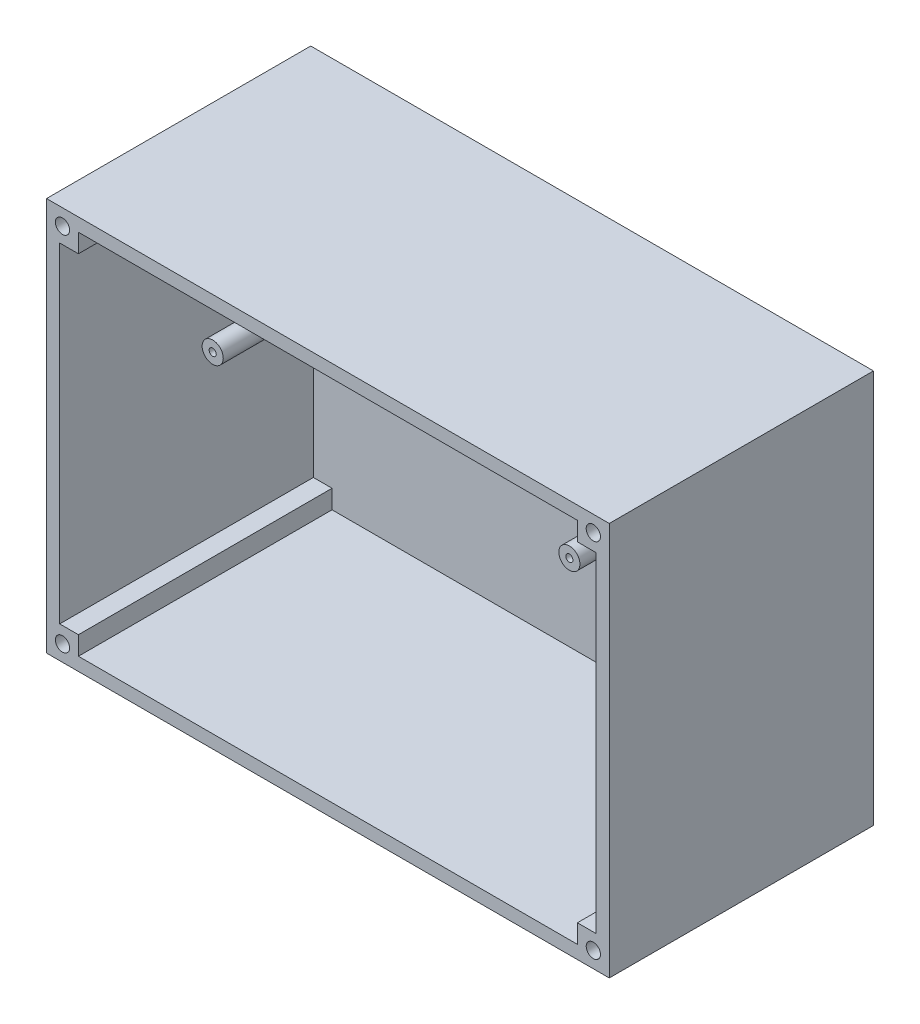
from build123d import *

# Parameters (mm, degrees)
SZKIC5_W                    = 213
SZKIC5_H                    = 149
DODANIE_WYCI_GNI_CIE1_DEPTH = 100
DODANIE_WYCI_GNI_CIE2_DEPTH = 4
SZKIC7_R                    = 4
SZKIC7_R_2                  = 1.35
DODANIE_WYCI_GNI_CIE3_DEPTH = 60
SZKIC8_R                    = 3.5
SZKIC8_R_2                  = 1.35
DODANIE_WYCI_GNI_CIE4_DEPTH = 15
SZKIC11_W                   = 7.071067811
SZKIC11_H                   = 7.071067811
SZKIC11_W_2                 = 7.071067812
SZKIC11_H_2                 = 7.071067812
DODANIE_WYCI_GNI_CIE5_DEPTH = 100
SZKIC12_R                   = 2.7
WYTNIJ_WYCI_GNI_CIE10_DEPTH = 50
SZKIC14_W                   = 0.763888889
SZKIC14_H                   = 0.833333333
SZKIC14_H_2                 = 3.680555556
WYTNIJ_WYCI_GNI_CIE11_DEPTH = 1


with BuildPart() as part:
    # Szkic5 → Dodanie-wyciągnięcie1 (new body)
    with BuildSketch(Plane(origin=(0, 0, 0), x_dir=(-1, 0, 0), z_dir=(0, 0, 1))):
        with Locations((-69.993932484, -6.91068095)):
            Rectangle(SZKIC5_W, SZKIC5_H)
        Polygon((31.506067516, 62.58931905), (-171.493932484, 62.58931905), (-171.493932484, -76.41068095), (31.506067516, -76.41068095), (31.506067516, 0), align=None, mode=Mode.SUBTRACT)
    extrude(amount=DODANIE_WYCI_GNI_CIE1_DEPTH)

    # Szkic4 → Dodanie-wyciągnięcie2 (add)
    with BuildSketch(Plane(origin=(0, 0, 0), x_dir=(-1, 0, 0), z_dir=(0, 0, 1))):
        Polygon((-171.493932484, -76.41068095), (31.506067516, -76.41068095), (31.506067516, 0), (31.506067516, 62.58931905), (-171.493932484, 62.58931905), align=None)
    extrude(amount=DODANIE_WYCI_GNI_CIE2_DEPTH)

    # Szkic7 → Dodanie-wyciągnięcie3 (add)
    # profile 1 of 4: a face of its own
    with BuildSketch(Plane(origin=(0, 0, 0), x_dir=(-1, 0, 0), z_dir=(0, 0, 1))):
        with Locations((13.611945375, -69.5)):
            Circle(SZKIC7_R)
        with Locations((13.611945375, -69.5)):
            Circle(SZKIC7_R_2, mode=Mode.SUBTRACT)
    # profile 2 of 4: a face of its own
    with BuildSketch(Plane(origin=(0, 0, 0), x_dir=(-1, 0, 0), z_dir=(0, 0, 1))):
        with Locations((13.611945375, -22.5)):
            Circle(SZKIC7_R)
        with Locations((13.611945375, -22.5)):
            Circle(SZKIC7_R_2, mode=Mode.SUBTRACT)
    # profile 3 of 4: a face of its own
    with BuildSketch(Plane(origin=(0, 0, 0), x_dir=(-1, 0, 0), z_dir=(0, 0, 1))):
        with Locations((-121.388054625, -69.5)):
            Circle(SZKIC7_R)
        with Locations((-121.388054625, -69.5)):
            Circle(SZKIC7_R_2, mode=Mode.SUBTRACT)
    # profile 4 of 4: a face of its own
    with BuildSketch(Plane(origin=(0, 0, 0), x_dir=(-1, 0, 0), z_dir=(0, 0, 1))):
        with Locations((-121.388054625, -22.5)):
            Circle(SZKIC7_R)
        with Locations((-121.388054625, -22.5)):
            Circle(SZKIC7_R_2, mode=Mode.SUBTRACT)
    extrude(amount=DODANIE_WYCI_GNI_CIE3_DEPTH)

    # Szkic8 → Dodanie-wyciągnięcie4 (add)
    # profile 1 of 6: a face of its own
    with BuildSketch(Plane(origin=(0, 0, 0), x_dir=(-1, 0, 0), z_dir=(0, 0, 1))):
        with Locations((-149.920751636, -27.948628453)):
            Circle(SZKIC8_R)
        with Locations((-149.920751636, -27.948628453)):
            Circle(SZKIC8_R_2, mode=Mode.SUBTRACT)
    # profile 2 of 6: a face of its own
    with BuildSketch(Plane(origin=(0, 0, 0), x_dir=(-1, 0, 0), z_dir=(0, 0, 1))):
        with Locations((-149.920751636, -54.948628453)):
            Circle(SZKIC8_R)
        with Locations((-149.920751636, -54.948628453)):
            Circle(SZKIC8_R_2, mode=Mode.SUBTRACT)
    # profile 3 of 6: a face of its own
    with BuildSketch(Plane(origin=(0, 0, 0), x_dir=(-1, 0, 0), z_dir=(0, 0, 1))):
        with Locations((-154.753932484, -0.71068095)):
            Circle(SZKIC8_R)
        with Locations((-154.753932484, -0.71068095)):
            Circle(SZKIC8_R_2, mode=Mode.SUBTRACT)
    # profile 4 of 6: a face of its own
    with BuildSketch(Plane(origin=(0, 0, 0), x_dir=(-1, 0, 0), z_dir=(0, 0, 1))):
        with Locations((-154.753932484, 47.54931905)):
            Circle(SZKIC8_R)
        with Locations((-154.753932484, 47.54931905)):
            Circle(SZKIC8_R_2, mode=Mode.SUBTRACT)
    # profile 5 of 6: a face of its own
    with BuildSketch(Plane(origin=(0, 0, 0), x_dir=(-1, 0, 0), z_dir=(0, 0, 1))):
        with Locations((-103.953932484, 42.46931905)):
            Circle(SZKIC8_R)
        with Locations((-103.953932484, 42.46931905)):
            Circle(SZKIC8_R_2, mode=Mode.SUBTRACT)
    # profile 6 of 6: a face of its own
    with BuildSketch(Plane(origin=(0, 0, 0), x_dir=(-1, 0, 0), z_dir=(0, 0, 1))):
        with Locations((-103.953932484, 14.52931905)):
            Circle(SZKIC8_R)
        with Locations((-103.953932484, 14.52931905)):
            Circle(SZKIC8_R_2, mode=Mode.SUBTRACT)
    extrude(amount=DODANIE_WYCI_GNI_CIE4_DEPTH)

    # Szkic11 → Dodanie-wyciągnięcie5 (add)
    with BuildSketch(Plane(origin=(0, 0, 0), x_dir=(-1, 0, 0), z_dir=(0, 0, 1))):
        with Locations((-167.958398579, -72.875147045)):
            Rectangle(SZKIC11_W, SZKIC11_H)
        with Locations((27.97053361, -72.875147045)):
            Rectangle(SZKIC11_W_2, SZKIC11_H)
        with Locations((-167.958398579, 59.053785144)):
            Rectangle(SZKIC11_W, SZKIC11_H_2)
        with Locations((27.97053361, 59.053785144)):
            Rectangle(SZKIC11_W_2, SZKIC11_H_2)
    extrude(amount=DODANIE_WYCI_GNI_CIE5_DEPTH)

    # Szkic12 → Wytnij-wyciągnięcie10 (cut)
    with BuildSketch(Plane.XY.offset(100)):
        with Locations((-30.47053361, 75.375147045)):
            Circle(SZKIC12_R)
        with Locations((-30.47053361, -61.553785144)):
            Circle(SZKIC12_R)
        with Locations((170.458398578, -61.553785144)):
            Circle(SZKIC12_R)
        with Locations((170.458398578, 75.375147045)):
            Circle(SZKIC12_R)
    extrude(amount=-WYTNIJ_WYCI_GNI_CIE10_DEPTH, mode=Mode.SUBTRACT)

    # Szkic14 → Wytnij-wyciągnięcie11 (cut)
    # profile 1 of 26: a face of its own
    with BuildSketch(Plane.XY.offset(4)):
        Polygon((25.429276509, 59.747676954), (26.435135884, 59.747676954), (27.784962273, 54.747676954), (26.946203592, 54.747676954), (26.627193176, 55.997676954), (25.140648037, 55.997676954), (24.825977898, 54.747676954), (24.034962273, 54.747676954), align=None)
        Polygon((26.466602898, 56.622676954), (25.875240051, 58.941470357), (25.295812967, 56.622676954), align=None, mode=Mode.SUBTRACT)
    # profile 2 of 26: a face of its own
    with BuildSketch(Plane.XY.offset(4)):
        with BuildLine():
            Line((31.174068176, 58.42823251), (31.591819912, 58.42823251))
            add(Edge.make_bspline(
                [(31.591819912, 58.42823251), (31.589434124, 58.372538983), (31.584214749, 58.250698564), (31.580769172, 58.052806035), (31.577012775, 57.824224308), (31.576762274, 57.661814121), (31.57662894, 57.575367926)],
                knots=[0, 0, 0, 0, 0.784125982, 1.715428042, 2.783989137, 4, 4, 4, 4], degree=3))
            Line((31.57662894, 57.575367926), (31.57662894, 53.497676954))
            Line((31.57662894, 53.497676954), (30.812740051, 53.497676954))
            Line((30.812740051, 53.497676954), (30.812740051, 55.215341885))
            add(Edge.make_bspline(
                [(30.812740051, 55.215341885), (30.786242938, 55.172690718), (30.734646099, 55.089637694), (30.642780403, 54.979841353), (30.543614209, 54.88591376), (30.434972738, 54.810613281), (30.318666548, 54.75109124), (30.193790945, 54.70849208), (30.060352599, 54.68326488), (29.968664524, 54.679932318), (29.921898037, 54.67823251)],
                knots=[0, 0, 0, 0, 1.100535629, 2.143031951, 3.131224948, 4.088865207, 5.032927805, 5.989087252, 6.97431236, 8, 8, 8, 8], degree=3))
            add(Edge.make_bspline(
                [(29.921898037, 54.67823251), (29.878035092, 54.679703801), (29.791572517, 54.682604009), (29.664563456, 54.705325878), (29.542469571, 54.740418663), (29.426558616, 54.792447419), (29.316309547, 54.858041741), (29.21123142, 54.937887948), (29.112719676, 55.033225919), (29.01872728, 55.141578633), (28.934535058, 55.265469883), (28.860229757, 55.403539253), (28.797308015, 55.555385739), (28.748215803, 55.722286143), (28.707778371, 55.901965606), (28.680419849, 56.096467736), (28.662531544, 56.304413815), (28.660834941, 56.447940693), (28.659962273, 56.521765496)],
                knots=[0, 0, 0, 0, 0.841010196, 1.657798106, 2.467986618, 3.27256946, 4.087734679, 4.924583919, 5.798168574, 6.713366575, 7.671838835, 8.665337514, 9.71684927, 10.818801846, 11.998924228, 13.247154238, 14.584040151, 16, 16, 16, 16], degree=3))
            add(Edge.make_bspline(
                [(28.659962273, 56.521765496), (28.660715244, 56.602827279), (28.662172907, 56.759753492), (28.681514226, 56.986837939), (28.709881177, 57.197905692), (28.750668941, 57.39287016), (28.804241053, 57.571559434), (28.866927784, 57.73533938), (28.94472214, 57.881529494), (29.032883291, 58.011748118), (29.130932106, 58.125536304), (29.235414825, 58.225567531), (29.347766662, 58.309521236), (29.466562143, 58.378191186), (29.591693177, 58.432325802), (29.724064022, 58.470123122), (29.863201881, 58.493443989), (29.958337347, 58.496253594), (30.006533454, 58.497676954)],
                knots=[0, 0, 0, 0, 1.446360827, 2.799986864, 4.06439729, 5.245657617, 6.350580689, 7.391095816, 8.370035782, 9.299293766, 10.192025944, 11.045916603, 11.876076903, 12.68878596, 13.489797037, 14.302916191, 15.140248797, 16, 16, 16, 16], degree=3))
            add(Edge.make_bspline(
                [(30.006533454, 58.497676954), (30.057304219, 58.495809685), (30.156408794, 58.492164775), (30.300188659, 58.46341439), (30.433948836, 58.415676515), (30.557131946, 58.34755434), (30.668709431, 58.25915544), (30.77041979, 58.152505584), (30.862284496, 58.027115048), (30.911941101, 57.933065085), (30.937523037, 57.884612718)],
                knots=[0, 0, 0, 0, 1.030304736, 2.011155696, 2.963634042, 3.903801236, 4.855826452, 5.842735066, 6.888626962, 8, 8, 8, 8], degree=3))
            add(Edge.make_bspline(
                [(30.937523037, 57.884612718), (30.958064861, 57.922800126), (31.000987192, 58.002593068), (31.062384836, 58.130811298), (31.118816142, 58.274757734), (31.155155087, 58.375697212), (31.174068176, 58.42823251)],
                knots=[0, 0, 0, 0, 0.876463709, 1.831379, 2.871312276, 4, 4, 4, 4], degree=3))
        make_face()
        with BuildLine():
            add(Edge.make_bspline(
                [(30.812740051, 56.90479501), (30.812046215, 56.944957056), (30.810694387, 57.023206427), (30.802229872, 57.137020804), (30.787360265, 57.243684352), (30.765310292, 57.342896635), (30.73856732, 57.435642138), (30.705137494, 57.521536617), (30.664920822, 57.599958591), (30.618866014, 57.67073033), (30.569876645, 57.734264332), (30.517030802, 57.789472527), (30.4615102, 57.836046968), (30.404350616, 57.875803158), (30.343568985, 57.90564493), (30.280220135, 57.925825512), (30.214742861, 57.939760756), (30.17008948, 57.941330526), (30.147592481, 57.942121399)],
                knots=[0, 0, 0, 0, 1.409101199, 2.745410028, 4.001653112, 5.184001665, 6.308336003, 7.385265332, 8.412526165, 9.394585668, 10.34396178, 11.223515045, 12.070041728, 12.883091676, 13.660604893, 14.435109106, 15.211586053, 16, 16, 16, 16], degree=3))
            add(Edge.make_bspline(
                [(30.147592481, 57.942121399), (30.121096017, 57.941533418), (30.06908291, 57.940379201), (29.994126592, 57.924071403), (29.923325868, 57.90096432), (29.859185199, 57.86523993), (29.799616638, 57.821591466), (29.745781829, 57.76720943), (29.697465346, 57.703077919), (29.653398752, 57.629411463), (29.61533144, 57.544106065), (29.58184385, 57.446910992), (29.555498738, 57.336248119), (29.532861723, 57.213458118), (29.514509534, 57.078054823), (29.501755152, 56.929598014), (29.494201047, 56.76851837), (29.493604398, 56.656684389), (29.493295606, 56.598805426)],
                knots=[0, 0, 0, 0, 0.760739194, 1.493346756, 2.197544577, 2.895952785, 3.595213137, 4.316275812, 5.088387348, 5.900347889, 6.780456774, 7.770946563, 8.853616179, 10.04956707, 11.362225144, 12.782867934, 14.334993832, 16, 16, 16, 16], degree=3))
            add(Edge.make_bspline(
                [(29.493295606, 56.598805426), (29.493615125, 56.543820464), (29.494235578, 56.437048772), (29.50177205, 56.282107233), (29.514842706, 56.13808472), (29.531780715, 56.004728391), (29.554531843, 55.881911134), (29.58203044, 55.76931342), (29.615955563, 55.667929632), (29.653673528, 55.576848866), (29.696988231, 55.496527447), (29.744654135, 55.426080321), (29.798088553, 55.366518225), (29.857520572, 55.31875021), (29.920920918, 55.278970633), (29.991088302, 55.254215941), (30.065330339, 55.236426094), (30.116733104, 55.234685864), (30.143252204, 55.233788065)],
                knots=[0, 0, 0, 0, 1.574963962, 3.058319256, 4.44189088, 5.716721185, 6.907526736, 8.018202384, 9.033868901, 9.967138122, 10.838670154, 11.643344411, 12.398824063, 13.120512651, 13.822369384, 14.530544819, 15.241896285, 16, 16, 16, 16], degree=3))
            add(Edge.make_bspline(
                [(30.143252204, 55.233788065), (30.164674982, 55.234531226), (30.207630526, 55.236021362), (30.270744983, 55.251030269), (30.332591214, 55.273917229), (30.392188058, 55.306918047), (30.449957621, 55.348559372), (30.505851624, 55.398939075), (30.558916936, 55.459540217), (30.610737582, 55.52836314), (30.659411378, 55.606894459), (30.699183312, 55.696121714), (30.736448116, 55.793413465), (30.763019956, 55.901145354), (30.786940217, 56.01787291), (30.800574455, 56.144284467), (30.811221176, 56.279975775), (30.812221234, 56.373447322), (30.812740051, 56.421939107)],
                knots=[0, 0, 0, 0, 0.682729064, 1.368963321, 2.059457538, 2.78276077, 3.535679788, 4.328607349, 5.179041066, 6.102655183, 7.076838241, 8.120256518, 9.216136442, 10.397868582, 11.656769363, 13.017190958, 14.452558691, 16, 16, 16, 16], degree=3))
            Line((30.812740051, 56.421939107), (30.812740051, 56.90479501))
        make_face(mode=Mode.SUBTRACT)
    # profile 3 of 26: a face of its own
    with BuildSketch(Plane.XY.offset(4)):
        with BuildLine():
            Line((33.07662894, 58.42823251), (33.840517829, 58.42823251))
            Line((33.840517829, 58.42823251), (33.840517829, 56.113779385))
            add(Edge.make_bspline(
                [(33.840517829, 56.113779385), (33.840583946, 56.075071744), (33.84071005, 56.00124571), (33.845510329, 55.895619596), (33.851353331, 55.800001483), (33.861289779, 55.71424741), (33.873029867, 55.638189819), (33.886653775, 55.571650036), (33.903510256, 55.51510722), (33.924298513, 55.467746211), (33.950355497, 55.428532635), (33.980874408, 55.39371799), (34.019469619, 55.365956761), (34.064060726, 55.342668078), (34.114834963, 55.324602734), (34.171997968, 55.311647982), (34.235278404, 55.304092254), (34.279587707, 55.303527713), (34.302757412, 55.30323251)],
                knots=[0, 0, 0, 0, 1.705652033, 3.25314389, 4.659118544, 5.92652215, 7.056013225, 8.050187437, 8.917415951, 9.652212588, 10.319791312, 10.985655118, 11.680645431, 12.400772598, 13.19745259, 14.048115868, 14.979343463, 16, 16, 16, 16], degree=3))
            add(Edge.make_bspline(
                [(34.302757412, 55.30323251), (34.331754481, 55.303916709), (34.38795061, 55.305242683), (34.468552314, 55.319646843), (34.542494579, 55.342761179), (34.610405172, 55.373725162), (34.670669145, 55.415585999), (34.723655974, 55.466837392), (34.770448997, 55.526491108), (34.810038335, 55.596899754), (34.844055104, 55.679227363), (34.872617223, 55.776071329), (34.897286906, 55.888494922), (34.917830438, 56.01635359), (34.931922734, 56.159901058), (34.944479756, 56.318302799), (34.950397244, 56.492423972), (34.951206384, 56.613632048), (34.95162894, 56.676930426)],
                knots=[0, 0, 0, 0, 0.81002451, 1.569822178, 2.279873013, 2.972055776, 3.648093856, 4.320415539, 5.026422113, 5.76020093, 6.57154999, 7.512082987, 8.579341406, 9.788006848, 11.130366639, 12.611001555, 14.23016658, 16, 16, 16, 16], degree=3))
            Line((34.95162894, 56.676930426), (34.95162894, 58.42823251))
            Line((34.95162894, 58.42823251), (35.715517829, 58.42823251))
            Line((35.715517829, 58.42823251), (35.715517829, 54.747676954))
            Line((35.715517829, 54.747676954), (35.021073384, 54.747676954))
            Line((35.021073384, 54.747676954), (35.021073384, 55.335784593))
            add(Edge.make_bspline(
                [(35.021073384, 55.335784593), (34.994833238, 55.283712162), (34.944141134, 55.183115879), (34.849915076, 55.048162884), (34.744132176, 54.933948921), (34.626348805, 54.840291136), (34.497482691, 54.766366006), (34.356307674, 54.715928105), (34.204835557, 54.682724322), (34.099672963, 54.679757908), (34.045595954, 54.67823251)],
                knots=[0, 0, 0, 0, 1.118129238, 2.160061338, 3.147366217, 4.096059215, 5.038099109, 5.984732354, 6.963703329, 8, 8, 8, 8], degree=3))
            add(Edge.make_bspline(
                [(34.045595954, 54.67823251), (33.991220189, 54.67973417), (33.886496484, 54.682626257), (33.737371594, 54.709143793), (33.602429836, 54.75055712), (33.484296847, 54.812021089), (33.381530147, 54.88929938), (33.29410369, 54.9808905), (33.222570448, 55.087328781), (33.175565003, 55.187476044), (33.14760484, 55.279423423), (33.128219379, 55.360550272), (33.112095211, 55.453330014), (33.099655793, 55.557693752), (33.088564067, 55.673798537), (33.081345527, 55.801562863), (33.076930546, 55.94085931), (33.076732184, 56.037459088), (33.07662894, 56.087737718)],
                knots=[0, 0, 0, 0, 1.314343241, 2.531327939, 3.652026638, 4.716492182, 5.73497656, 6.749959493, 7.764376545, 8.82527591, 9.411972956, 10.086847015, 10.842076413, 11.688599242, 12.628913327, 13.663211077, 14.783738977, 16, 16, 16, 16], degree=3))
            Line((33.07662894, 56.087737718), (33.07662894, 58.42823251))
        make_face()
    # profile 4 of 26: a face of its own
    with BuildSketch(Plane.XY.offset(4)):
        with BuildLine():
            Line((37.909962273, 57.386565843), (37.215517829, 57.476626607))
            add(Edge.make_bspline(
                [(37.215517829, 57.476626607), (37.222375073, 57.515851276), (37.235918621, 57.593322795), (37.268679422, 57.704933365), (37.310841759, 57.809844259), (37.363871685, 57.90731424), (37.425281371, 57.998813499), (37.497839351, 58.082423312), (37.578598232, 58.160542114), (37.669664952, 58.23042666), (37.768271878, 58.292480653), (37.871490894, 58.349220108), (37.981649863, 58.393606081), (38.096189621, 58.432677431), (38.216620763, 58.460945355), (38.342167535, 58.483621981), (38.473269363, 58.494837703), (38.562434663, 58.496721458), (38.607661926, 58.497676954)],
                knots=[0, 0, 0, 0, 1.007614848, 1.990111223, 2.939083747, 3.865153757, 4.794839476, 5.723622587, 6.662822619, 7.635538399, 8.623822726, 9.611300481, 10.613071615, 11.626703366, 12.672909875, 13.74191655, 14.85463365, 16, 16, 16, 16], degree=3))
            add(Edge.make_bspline(
                [(38.607661926, 58.497676954), (38.648177325, 58.496934676), (38.727132919, 58.495488138), (38.84255221, 58.487657464), (38.950928794, 58.47026049), (39.054011206, 58.450872964), (39.150181495, 58.422025004), (39.24086798, 58.388869961), (39.325090995, 58.348377994), (39.426283914, 58.287458245), (39.53783314, 58.203575722), (39.647769513, 58.08987885), (39.728981475, 57.965311396), (39.773096089, 57.852087145), (39.797207964, 57.755303191), (39.811849072, 57.674001507), (39.825026598, 57.584270015), (39.835619271, 57.485804221), (39.844145485, 57.378338386), (39.850887072, 57.262222058), (39.853746441, 57.137376438), (39.85418177, 57.051280101), (39.854406717, 57.006791537)],
                knots=[0, 0, 0, 0, 1.06927037, 2.083772561, 3.048812809, 3.964056747, 4.848942558, 5.69451067, 6.509807394, 7.310165, 8.808545905, 10.178880126, 11.462773802, 12.705096885, 13.364782236, 14.092918343, 14.883831703, 15.7575304, 16.70542994, 17.728202971, 18.826094244, 20, 20, 20, 20], degree=3))
            Line((39.854406717, 57.006791537), (39.854406717, 55.760046746))
            add(Edge.make_bspline(
                [(39.854406717, 55.760046746), (39.854547169, 55.699641108), (39.854816321, 55.583884133), (39.858698846, 55.417883846), (39.861855854, 55.267323545), (39.870355219, 55.132839681), (39.87780172, 55.013989745), (39.89041056, 54.911370656), (39.902296551, 54.823854765), (39.91412973, 54.771489934), (39.919510884, 54.747676954)],
                knots=[0, 0, 0, 0, 1.42649394, 2.733629334, 3.92142086, 4.982281313, 5.915833823, 6.732719483, 7.423702414, 8, 8, 8, 8], degree=3))
            Line((39.919510884, 54.747676954), (39.196854634, 54.747676954))
            add(Edge.make_bspline(
                [(39.196854634, 54.747676954), (39.189429606, 54.785568634), (39.172906287, 54.869891044), (39.159201682, 55.011074853), (39.150910966, 55.178342764), (39.149739372, 55.298516735), (39.149111579, 55.362911329)],
                knots=[0, 0, 0, 0, 0.749216154, 1.667271361, 2.750019556, 4, 4, 4, 4], degree=3))
            add(Edge.make_bspline(
                [(39.149111579, 55.362911329), (39.119684494, 55.308567774), (39.062773518, 55.203469195), (38.958221266, 55.063493108), (38.844592571, 54.943954394), (38.718770457, 54.846484396), (38.581982597, 54.771452425), (38.434692949, 54.715862665), (38.275863975, 54.684537595), (38.166532918, 54.680363912), (38.11070012, 54.67823251)],
                knots=[0, 0, 0, 0, 1.125216648, 2.176130576, 3.173940892, 4.123403219, 5.064727738, 6.007666999, 6.982562426, 8, 8, 8, 8], degree=3))
            add(Edge.make_bspline(
                [(38.11070012, 54.67823251), (38.072690456, 54.679062123), (37.998247832, 54.680686937), (37.889508498, 54.69349775), (37.786795615, 54.716600674), (37.689701334, 54.748013025), (37.598083212, 54.788360981), (37.512045449, 54.837130044), (37.431944414, 54.895316802), (37.358508534, 54.962357789), (37.29265164, 55.037174096), (37.234076354, 55.118171244), (37.185528407, 55.20655241), (37.145038322, 55.300931098), (37.115186394, 55.402004708), (37.091720367, 55.508834897), (37.07912853, 55.622663397), (37.07747336, 55.700702271), (37.07662894, 55.740515496)],
                knots=[0, 0, 0, 0, 1.089490882, 2.133787846, 3.132460535, 4.103017476, 5.054726856, 5.997412939, 6.932771742, 7.886906726, 8.841830111, 9.785598989, 10.74635882, 11.726614957, 12.723725494, 13.762914075, 14.858702076, 16, 16, 16, 16], degree=3))
            add(Edge.make_bspline(
                [(37.07662894, 55.740515496), (37.077800158, 55.789414686), (37.080083104, 55.884729258), (37.100170806, 56.023612926), (37.132407867, 56.154692222), (37.178527383, 56.277791024), (37.235878948, 56.39423309), (37.308099138, 56.501566592), (37.392585908, 56.601557421), (37.490797687, 56.693745135), (37.606488397, 56.775669453), (37.739598483, 56.847621137), (37.892372037, 56.906473316), (38.063145876, 56.956662382), (38.253603613, 56.993513058), (38.462354618, 57.020239857), (38.689868958, 57.036551459), (38.847795845, 57.038388333), (38.929927551, 57.039343621)],
                knots=[0, 0, 0, 0, 0.909618135, 1.773032721, 2.605644495, 3.417118232, 4.214851501, 5.015759162, 5.818164615, 6.646848952, 7.515417205, 8.449100021, 9.455328789, 10.55656493, 11.757865134, 13.061178233, 14.47163172, 16, 16, 16, 16], degree=3))
            add(Edge.make_bspline(
                [(38.929927551, 57.039343621), (38.95199122, 57.039011901), (39.005526829, 57.038207013), (39.059052015, 57.036872772), (39.090517829, 57.036088412)],
                knots=[0, 0, 0, 0, 0.824261422, 2, 2, 2, 2], degree=3))
            Line((39.090517829, 57.036088412), (39.090517829, 57.179317579))
            add(Edge.make_bspline(
                [(39.090517829, 57.179317579), (39.08921832, 57.238343131), (39.086775465, 57.349301114), (39.064885434, 57.504882462), (39.026368444, 57.637364617), (38.98124139, 57.732422102), (38.935668774, 57.795465355), (38.895042449, 57.83477897), (38.848169283, 57.86756175), (38.796630848, 57.896281517), (38.737696949, 57.916380989), (38.673461709, 57.93184695), (38.602806438, 57.940067537), (38.553788033, 57.941421549), (38.528451856, 57.942121399)],
                knots=[0, 0, 0, 0, 1.946274314, 3.658664184, 5.16464565, 6.482392088, 7.105121809, 7.720957631, 8.3366779, 8.987893016, 9.659547583, 10.382922017, 11.164179812, 12, 12, 12, 12], degree=3))
            add(Edge.make_bspline(
                [(38.528451856, 57.942121399), (38.487425261, 57.940626077), (38.408801914, 57.937760443), (38.29732615, 57.911277891), (38.198517318, 57.867727751), (38.113201704, 57.80517629), (38.040213304, 57.725953208), (37.983062078, 57.627740196), (37.936459667, 57.513966244), (37.919072546, 57.430368356), (37.909962273, 57.386565843)],
                knots=[0, 0, 0, 0, 1.071363104, 2.053159719, 2.975973075, 3.876416629, 4.800150304, 5.771690017, 6.832439697, 8, 8, 8, 8], degree=3))
        make_face()
        with BuildLine():
            add(Edge.make_bspline(
                [(39.090517829, 56.539126607), (39.068101647, 56.54138332), (39.026558106, 56.545565648), (38.968321135, 56.55016825), (38.918727617, 56.552183042), (38.888333999, 56.5529057), (38.874589009, 56.55323251)],
                knots=[0, 0, 0, 0, 1.248934062, 2.314628927, 3.237819961, 4, 4, 4, 4], degree=3))
            add(Edge.make_bspline(
                [(38.874589009, 56.55323251), (38.835513095, 56.552548593), (38.760154178, 56.551229641), (38.650640798, 56.542791644), (38.548868862, 56.527439985), (38.453938153, 56.507458353), (38.366989058, 56.480014916), (38.286987384, 56.447915399), (38.215219365, 56.408488896), (38.150243767, 56.364056056), (38.093727759, 56.312611042), (38.044073224, 56.255743606), (38.002823938, 56.192385426), (37.969104118, 56.123005101), (37.941498019, 56.048314981), (37.923934154, 55.966828915), (37.911069023, 55.88017518), (37.910337514, 55.820139819), (37.909962273, 55.789343621)],
                knots=[0, 0, 0, 0, 1.334103456, 2.572853208, 3.746372492, 4.845972819, 5.880927732, 6.855485151, 7.783808648, 8.670979503, 9.536488623, 10.385635709, 11.241846104, 12.108851351, 13.015066757, 13.952624278, 14.949762506, 16, 16, 16, 16], degree=3))
            add(Edge.make_bspline(
                [(37.909962273, 55.789343621), (37.911186835, 55.745816449), (37.913492267, 55.663869673), (37.936453928, 55.549635534), (37.972579875, 55.45169921), (38.025609678, 55.370954579), (38.095031751, 55.308108496), (38.18024599, 55.264230459), (38.279892572, 55.23806339), (38.351055399, 55.2352615), (38.388477898, 55.233788065)],
                knots=[0, 0, 0, 0, 1.24392709, 2.341889225, 3.318161675, 4.213647979, 5.078225106, 5.966989166, 6.930897648, 8, 8, 8, 8], degree=3))
            add(Edge.make_bspline(
                [(38.388477898, 55.233788065), (38.411705285, 55.234498093), (38.457524356, 55.235898715), (38.525099249, 55.250952453), (38.590037694, 55.27471524), (38.652965023, 55.308187506), (38.713923308, 55.350280816), (38.771198687, 55.40372047), (38.828250061, 55.464084593), (38.88073122, 55.535259846), (38.930857039, 55.613185239), (38.972787608, 55.700304222), (39.010179888, 55.793172282), (39.038733297, 55.894148419), (39.063166743, 56.001197901), (39.078789966, 56.115937099), (39.088787309, 56.237296426), (39.08993159, 56.320644473), (39.090517829, 56.363345357)],
                knots=[0, 0, 0, 0, 0.758310501, 1.49586704, 2.251591334, 3.013305855, 3.820306043, 4.665893269, 5.5695988, 6.532199632, 7.552558324, 8.594413458, 9.688003037, 10.821836179, 12.021121906, 13.275408493, 14.604136871, 16, 16, 16, 16], degree=3))
            Line((39.090517829, 56.363345357), (39.090517829, 56.539126607))
        make_face(mode=Mode.SUBTRACT)
    # profile 5 of 26: a face of its own
    with BuildSketch(Plane.XY.offset(4)):
        with BuildLine():
            Line((41.354406717, 58.42823251), (42.048851162, 58.42823251))
            Line((42.048851162, 58.42823251), (42.048851162, 57.618770704))
            add(Edge.make_bspline(
                [(42.048851162, 57.618770704), (42.074318701, 57.688025016), (42.122687769, 57.819555845), (42.212095321, 57.999718407), (42.311305546, 58.152550952), (42.420111687, 58.278508572), (42.539021758, 58.376697794), (42.668265242, 58.446412562), (42.807845074, 58.489751695), (42.904662382, 58.495008846), (42.953799079, 58.497676954)],
                knots=[0, 0, 0, 0, 1.309316266, 2.486710938, 3.562427852, 4.536182092, 5.430750595, 6.284035313, 7.129114013, 8, 8, 8, 8], degree=3))
            add(Edge.make_bspline(
                [(42.953799079, 58.497676954), (42.974807206, 58.497350211), (43.020600687, 58.496637976), (43.065964844, 58.490271866), (43.090517829, 58.48682626)],
                knots=[0, 0, 0, 0, 0.917516091, 2, 2, 2, 2], degree=3))
            Line((43.090517829, 58.48682626), (43.090517829, 57.722937371))
            add(Edge.make_bspline(
                [(43.090517829, 57.722937371), (43.061981035, 57.726383412), (43.010791441, 57.732564957), (42.959247553, 57.73341285), (42.936437967, 57.733788065)],
                knots=[0, 0, 0, 0, 1.114945089, 2, 2, 2, 2], degree=3))
            add(Edge.make_bspline(
                [(42.936437967, 57.733788065), (42.903485482, 57.732974193), (42.839119714, 57.731384465), (42.745918861, 57.718504601), (42.659242626, 57.696238106), (42.578164807, 57.667607957), (42.504019082, 57.628386924), (42.437384056, 57.579563689), (42.375824273, 57.524234287), (42.32115429, 57.45900724), (42.272543373, 57.385586101), (42.231086853, 57.303126471), (42.196842468, 57.212359305), (42.166961277, 57.113606154), (42.146280764, 57.005492138), (42.129743349, 56.889302203), (42.120042394, 56.764260839), (42.118890249, 56.678031968), (42.118295606, 56.633527649)],
                knots=[0, 0, 0, 0, 1.011842218, 1.976421487, 2.88167244, 3.756702845, 4.611401665, 5.446899521, 6.288284348, 7.147375314, 8.053171353, 8.987137729, 9.975287635, 11.029710091, 12.151660405, 13.35188382, 14.633258124, 16, 16, 16, 16], degree=3))
            Line((42.118295606, 56.633527649), (42.118295606, 54.747676954))
            Line((42.118295606, 54.747676954), (41.354406717, 54.747676954))
            Line((41.354406717, 54.747676954), (41.354406717, 58.42823251))
        make_face()
    # profile 6 of 26: a face of its own
    with BuildSketch(Plane.XY.offset(4)):
        with Locations((44.486351162, 59.331010288)):
            Rectangle(SZKIC14_W, SZKIC14_H)
    # profile 7 of 26: a face of its own
    with BuildSketch(Plane.XY.offset(4)):
        with Locations((44.486351162, 56.587954732)):
            Rectangle(SZKIC14_W, SZKIC14_H_2)
    # profile 8 of 26: a face of its own
    with BuildSketch(Plane.XY.offset(4)):
        with BuildLine():
            Line((46.368295606, 58.42823251), (47.132184495, 58.42823251))
            Line((47.132184495, 58.42823251), (47.132184495, 56.113779385))
            add(Edge.make_bspline(
                [(47.132184495, 56.113779385), (47.132250613, 56.075071744), (47.132376717, 56.00124571), (47.137176995, 55.895619596), (47.143019998, 55.800001483), (47.152956446, 55.71424741), (47.164696533, 55.638189819), (47.178320442, 55.571650036), (47.195176923, 55.51510722), (47.215965179, 55.467746211), (47.242022163, 55.428532635), (47.272541075, 55.39371799), (47.311136286, 55.365956761), (47.355727393, 55.342668078), (47.40650163, 55.324602734), (47.463664635, 55.311647982), (47.52694507, 55.304092254), (47.571254373, 55.303527713), (47.594424079, 55.30323251)],
                knots=[0, 0, 0, 0, 1.705652033, 3.25314389, 4.659118544, 5.92652215, 7.056013225, 8.050187437, 8.917415951, 9.652212588, 10.319791312, 10.985655118, 11.680645431, 12.400772598, 13.19745259, 14.048115868, 14.979343463, 16, 16, 16, 16], degree=3))
            add(Edge.make_bspline(
                [(47.594424079, 55.30323251), (47.623421148, 55.303916709), (47.679617277, 55.305242683), (47.76021898, 55.319646843), (47.834161246, 55.342761179), (47.902071839, 55.373725162), (47.962335812, 55.415585999), (48.01532264, 55.466837392), (48.062115663, 55.526491108), (48.101705002, 55.596899754), (48.13572177, 55.679227363), (48.16428389, 55.776071329), (48.188953573, 55.888494922), (48.209497105, 56.01635359), (48.223589401, 56.159901058), (48.236146423, 56.318302799), (48.242063911, 56.492423972), (48.24287305, 56.613632048), (48.243295606, 56.676930426)],
                knots=[0, 0, 0, 0, 0.81002451, 1.569822178, 2.279873013, 2.972055776, 3.648093856, 4.320415539, 5.026422113, 5.76020093, 6.57154999, 7.512082987, 8.579341406, 9.788006848, 11.130366639, 12.611001555, 14.23016658, 16, 16, 16, 16], degree=3))
            Line((48.243295606, 56.676930426), (48.243295606, 58.42823251))
            Line((48.243295606, 58.42823251), (49.007184495, 58.42823251))
            Line((49.007184495, 58.42823251), (49.007184495, 54.747676954))
            Line((49.007184495, 54.747676954), (48.312740051, 54.747676954))
            Line((48.312740051, 54.747676954), (48.312740051, 55.335784593))
            add(Edge.make_bspline(
                [(48.312740051, 55.335784593), (48.286499905, 55.283712162), (48.2358078, 55.183115879), (48.141581742, 55.048162884), (48.035798842, 54.933948921), (47.918015472, 54.840291136), (47.789149358, 54.766366006), (47.647974341, 54.715928105), (47.496502224, 54.682724322), (47.391339629, 54.679757908), (47.33726262, 54.67823251)],
                knots=[0, 0, 0, 0, 1.118129238, 2.160061338, 3.147366217, 4.096059215, 5.038099109, 5.984732354, 6.963703329, 8, 8, 8, 8], degree=3))
            add(Edge.make_bspline(
                [(47.33726262, 54.67823251), (47.282886855, 54.67973417), (47.178163151, 54.682626257), (47.029038261, 54.709143793), (46.894096503, 54.75055712), (46.775963513, 54.812021089), (46.673196814, 54.88929938), (46.585770357, 54.9808905), (46.514237115, 55.087328781), (46.46723167, 55.187476044), (46.439271507, 55.279423423), (46.419886046, 55.360550272), (46.403761878, 55.453330014), (46.391322459, 55.557693752), (46.380230734, 55.673798537), (46.373012194, 55.801562863), (46.368597213, 55.94085931), (46.368398851, 56.037459088), (46.368295606, 56.087737718)],
                knots=[0, 0, 0, 0, 1.314343241, 2.531327939, 3.652026638, 4.716492182, 5.73497656, 6.749959493, 7.764376545, 8.82527591, 9.411972956, 10.086847015, 10.842076413, 11.688599242, 12.628913327, 13.663211077, 14.783738977, 16, 16, 16, 16], degree=3))
            Line((46.368295606, 56.087737718), (46.368295606, 58.42823251))
        make_face()
    # profile 9 of 26: a face of its own
    with BuildSketch(Plane.XY.offset(4)):
        with BuildLine():
            Line((50.507184495, 58.42823251), (51.20162894, 58.42823251))
            Line((51.20162894, 58.42823251), (51.20162894, 57.852060635))
            add(Edge.make_bspline(
                [(51.20162894, 57.852060635), (51.224903996, 57.90304602), (51.269914539, 58.001644272), (51.356943803, 58.133496452), (51.453076405, 58.247816095), (51.564680592, 58.338502486), (51.686460932, 58.410129373), (51.820010449, 58.461880694), (51.965561688, 58.492658791), (52.066639888, 58.495975063), (52.11851262, 58.497676954)],
                knots=[0, 0, 0, 0, 1.121582374, 2.168975697, 3.155621936, 4.103155901, 5.035487202, 5.976344391, 6.961471953, 8, 8, 8, 8], degree=3))
            add(Edge.make_bspline(
                [(52.11851262, 58.497676954), (52.174728386, 58.495688268), (52.282335651, 58.491881558), (52.435087807, 58.460579376), (52.570444406, 58.407231785), (52.687556041, 58.330974963), (52.787435978, 58.233464292), (52.868144301, 58.113618641), (52.931971171, 57.97315451), (52.957172221, 57.869971453), (52.970292134, 57.816253343)],
                knots=[0, 0, 0, 0, 1.124303641, 2.152122924, 3.103789131, 4.019312066, 4.930446318, 5.878112461, 6.895324555, 8, 8, 8, 8], degree=3))
            add(Edge.make_bspline(
                [(52.970292134, 57.816253343), (52.992689251, 57.87015416), (53.035993394, 57.974369745), (53.122834809, 58.113690979), (53.220676596, 58.233733154), (53.334215447, 58.329867347), (53.459647408, 58.40677194), (53.599488073, 58.459727537), (53.752267025, 58.491722516), (53.858440669, 58.49565046), (53.913217481, 58.497676954)],
                knots=[0, 0, 0, 0, 1.120643731, 2.16673047, 3.144442199, 4.08660713, 5.013347752, 5.960044995, 6.947552051, 8, 8, 8, 8], degree=3))
            add(Edge.make_bspline(
                [(53.913217481, 58.497676954), (53.967602734, 58.496269826), (54.072052317, 58.493567366), (54.221781943, 58.465726716), (54.35797162, 58.420784501), (54.478675715, 58.35582418), (54.58475166, 58.278304334), (54.672850907, 58.186408124), (54.7446769, 58.083663032), (54.788717004, 57.986330242), (54.815870152, 57.89801809), (54.834066961, 57.817881867), (54.84835888, 57.724617118), (54.86231457, 57.618363008), (54.86927624, 57.498709317), (54.877810496, 57.366051684), (54.881803991, 57.220211978), (54.882053825, 57.118554715), (54.882184495, 57.065385287)],
                knots=[0, 0, 0, 0, 1.299018523, 2.494829675, 3.627002449, 4.714087009, 5.758758131, 6.755662384, 7.743977672, 8.742381143, 9.294895794, 9.95150498, 10.705008695, 11.55024314, 12.512642452, 13.569413316, 14.728739123, 16, 16, 16, 16], degree=3))
            Line((54.882184495, 57.065385287), (54.882184495, 54.747676954))
            Line((54.882184495, 54.747676954), (54.118295606, 54.747676954))
            Line((54.118295606, 54.747676954), (54.118295606, 56.989430426))
            add(Edge.make_bspline(
                [(54.118295606, 56.989430426), (54.118179499, 57.030665852), (54.117957394, 57.109545925), (54.113764738, 57.222836735), (54.105856688, 57.325909664), (54.096978576, 57.418727847), (54.083528977, 57.500824468), (54.068913017, 57.572771981), (54.050923837, 57.634725588), (54.022927448, 57.701955664), (53.974682758, 57.772428395), (53.891179752, 57.833987482), (53.783055401, 57.866534653), (53.704730565, 57.870527506), (53.66256644, 57.872676954)],
                knots=[0, 0, 0, 0, 1.301065858, 2.488835022, 3.575954078, 4.562781959, 5.429600097, 6.199579038, 6.878402173, 7.461329964, 8.493507428, 9.529777727, 10.670220511, 12, 12, 12, 12], degree=3))
            add(Edge.make_bspline(
                [(53.66256644, 57.872676954), (53.639026844, 57.871660847), (53.592786857, 57.869664858), (53.525445966, 57.859421555), (53.463024474, 57.839664431), (53.40560462, 57.811800442), (53.352267423, 57.777350494), (53.303660722, 57.734146556), (53.260786482, 57.682761905), (53.220986946, 57.624536998), (53.186472491, 57.558244496), (53.157483987, 57.483834559), (53.132600231, 57.40219298), (53.112148583, 57.312974065), (53.096104071, 57.216213491), (53.08401846, 57.111948188), (53.077840521, 56.999634167), (53.07704254, 56.922162719), (53.07662894, 56.882008551)],
                knots=[0, 0, 0, 0, 0.872488681, 1.713872429, 2.514705821, 3.287711283, 4.071783298, 4.859509616, 5.686368033, 6.544753283, 7.467630179, 8.447851821, 9.498855924, 10.626561149, 11.835760397, 13.130341743, 14.512629617, 16, 16, 16, 16], degree=3))
            Line((53.07662894, 56.882008551), (53.07662894, 54.747676954))
            Line((53.07662894, 54.747676954), (52.312740051, 54.747676954))
            Line((52.312740051, 54.747676954), (52.312740051, 56.964473829))
            add(Edge.make_bspline(
                [(52.312740051, 56.964473829), (52.312326616, 57.002088358), (52.311539496, 57.073700988), (52.311218642, 57.176092812), (52.307641861, 57.267961487), (52.30351848, 57.349735127), (52.298029613, 57.420989547), (52.292353294, 57.481976231), (52.283091485, 57.532109075), (52.272409676, 57.584965931), (52.253272628, 57.64100605), (52.22101899, 57.699838768), (52.180658757, 57.751572825), (52.131458378, 57.794804672), (52.075135801, 57.830712796), (52.01060204, 57.855423953), (51.938262516, 57.869418126), (51.88781827, 57.87155551), (51.861351162, 57.872676954)],
                knots=[0, 0, 0, 0, 1.550620058, 2.952156551, 4.220220731, 5.339993836, 6.326815351, 7.16650456, 7.862618337, 8.427002837, 9.38884325, 10.289581105, 11.181390721, 12.079038557, 12.976686392, 13.920799808, 14.909084365, 16, 16, 16, 16], degree=3))
            add(Edge.make_bspline(
                [(51.861351162, 57.872676954), (51.835608867, 57.872327907), (51.785985905, 57.871655055), (51.714439843, 57.858673158), (51.648501413, 57.840711395), (51.587476881, 57.816189559), (51.533712284, 57.781258718), (51.484802908, 57.740420104), (51.441910236, 57.691627786), (51.404417585, 57.635557475), (51.373650789, 57.570380575), (51.34459117, 57.497554876), (51.323181464, 57.414560189), (51.302589447, 57.322881272), (51.28989654, 57.221100645), (51.278559735, 57.110085979), (51.272260882, 56.989863137), (51.271478121, 56.906609624), (51.271073384, 56.863562371)],
                knots=[0, 0, 0, 0, 0.926792575, 1.786561448, 2.612426413, 3.389917768, 4.146116093, 4.914253663, 5.681061506, 6.480449193, 7.33784082, 8.275126582, 9.303444232, 10.423823433, 11.661418915, 12.998058176, 14.447809053, 16, 16, 16, 16], degree=3))
            Line((51.271073384, 56.863562371), (51.271073384, 54.747676954))
            Line((51.271073384, 54.747676954), (50.507184495, 54.747676954))
            Line((50.507184495, 54.747676954), (50.507184495, 58.42823251))
        make_face()
    # profile 10 of 26: a face of its own
    with BuildSketch(Plane.XY.offset(4)):
        with BuildLine():
            Line((56.45162894, 59.747676954), (57.982661926, 59.747676954))
            add(Edge.make_bspline(
                [(57.982661926, 59.747676954), (58.029322884, 59.747557221), (58.11977369, 59.747325123), (58.251487377, 59.743013673), (58.374468019, 59.735257822), (58.488876299, 59.725892587), (58.594253784, 59.713068125), (58.690809558, 59.696589884), (58.778982881, 59.67859886), (58.884658457, 59.650152987), (59.00825138, 59.599803342), (59.143938093, 59.510393082), (59.264642356, 59.389960857), (59.37378565, 59.246380102), (59.465127146, 59.079835395), (59.52979634, 58.893184214), (59.56995185, 58.689635018), (59.574351141, 58.548147674), (59.57662894, 58.474890496)],
                knots=[0, 0, 0, 0, 0.948682029, 1.838990403, 2.678914336, 3.453905497, 4.172671958, 4.836399925, 5.445043722, 6.001661824, 7.060061993, 8.143109958, 9.282015683, 10.510139552, 11.800157571, 13.125901341, 14.511892649, 16, 16, 16, 16], degree=3))
            add(Edge.make_bspline(
                [(59.57662894, 58.474890496), (59.574406742, 58.408194237), (59.570134626, 58.279972424), (59.535619162, 58.095944422), (59.475339007, 57.930784105), (59.393470924, 57.781759572), (59.284964149, 57.652601484), (59.154018311, 57.540477759), (58.998647247, 57.447070187), (58.883333954, 57.402211438), (58.823590745, 57.378970357)],
                knots=[0, 0, 0, 0, 1.116808313, 2.147034776, 3.120711294, 4.051106003, 4.980454559, 5.930062871, 6.927576504, 8, 8, 8, 8], degree=3))
            add(Edge.make_bspline(
                [(58.823590745, 57.378970357), (58.859949277, 57.366828843), (58.931049737, 57.343085663), (59.032265858, 57.299498846), (59.126235584, 57.250011679), (59.214103449, 57.196777389), (59.293935583, 57.135845297), (59.367599454, 57.071339471), (59.434731353, 57.00114119), (59.494319663, 56.925206329), (59.546796988, 56.843512263), (59.590927367, 56.755764809), (59.630297977, 56.664020243), (59.662094604, 56.566390311), (59.685477839, 56.463133255), (59.702588916, 56.35474592), (59.714096833, 56.240978707), (59.715036047, 56.163360303), (59.715517829, 56.12354501)],
                knots=[0, 0, 0, 0, 1.102821879, 2.156609143, 3.166933216, 4.157765763, 5.109157629, 6.053117973, 6.973423976, 7.900065663, 8.826941174, 9.762658675, 10.72351285, 11.697860233, 12.712891973, 13.76703904, 14.854575842, 16, 16, 16, 16], degree=3))
            add(Edge.make_bspline(
                [(59.715517829, 56.12354501), (59.71448678, 56.078287171), (59.712450842, 55.988919672), (59.695877333, 55.856650872), (59.667727324, 55.728851153), (59.628427491, 55.605374655), (59.578215611, 55.486674123), (59.517399131, 55.371904381), (59.443863209, 55.26247937), (59.361001563, 55.15612733), (59.261650395, 55.057452808), (59.140095085, 54.973860795), (58.998622559, 54.90325108), (58.836820821, 54.846825454), (58.655790373, 54.80077638), (58.454013688, 54.77098775), (58.232274699, 54.750861456), (58.077475589, 54.748768277), (57.996767829, 54.747676954)],
                knots=[0, 0, 0, 0, 0.863358473, 1.704813771, 2.538706933, 3.357178983, 4.173670103, 4.994930624, 5.831390056, 6.686099203, 7.564551734, 8.491210427, 9.488114996, 10.573032508, 11.754756268, 13.047097197, 14.460442233, 16, 16, 16, 16], degree=3))
            Line((57.996767829, 54.747676954), (56.45162894, 54.747676954))
            Line((56.45162894, 54.747676954), (56.45162894, 59.747676954))
        make_face()
        with BuildLine():
            Line((57.284962273, 57.664343621), (57.793859842, 57.664343621))
            add(Edge.make_bspline(
                [(57.793859842, 57.664343621), (57.83692077, 57.664908688), (57.919185209, 57.665988203), (58.036644669, 57.675684596), (58.142604512, 57.691660885), (58.237511502, 57.714124419), (58.320895265, 57.742992078), (58.39337467, 57.777685795), (58.453923841, 57.820266096), (58.518799232, 57.885955668), (58.581520463, 57.981774036), (58.636452424, 58.109853717), (58.667947204, 58.253856863), (58.671831158, 58.354294529), (58.673851162, 58.406531121)],
                knots=[0, 0, 0, 0, 1.163142808, 2.222090785, 3.181163278, 4.055672457, 4.852969237, 5.560892853, 6.219706869, 6.841542533, 8.044829802, 9.288078823, 10.589557815, 12, 12, 12, 12], degree=3))
            add(Edge.make_bspline(
                [(58.673851162, 58.406531121), (58.673164903, 58.43729258), (58.671837964, 58.496772437), (58.663416377, 58.582845385), (58.648318866, 58.662418465), (58.627069064, 58.735393906), (58.598364813, 58.801005521), (58.564834379, 58.860448744), (58.524644558, 58.912697453), (58.477996893, 58.958039927), (58.425411673, 58.997265969), (58.366131723, 59.031411433), (58.299725996, 59.058627939), (58.227636315, 59.083604013), (58.148013313, 59.099848106), (58.062193234, 59.112798937), (57.969840443, 59.122133353), (57.906007831, 59.122491928), (57.873069912, 59.122676954)],
                knots=[0, 0, 0, 0, 1.188671328, 2.298395588, 3.337211698, 4.314409663, 5.228294314, 6.098497032, 6.94549623, 7.765785721, 8.604325724, 9.474528442, 10.401253204, 11.373541854, 12.417983363, 13.534725712, 14.727907209, 16, 16, 16, 16], degree=3))
            Line((57.873069912, 59.122676954), (57.284962273, 59.122676954))
            Line((57.284962273, 59.122676954), (57.284962273, 57.664343621))
        make_face(mode=Mode.SUBTRACT)
        with BuildLine():
            Line((57.284962273, 55.442121399), (57.928408454, 55.442121399))
            add(Edge.make_bspline(
                [(57.928408454, 55.442121399), (57.964224923, 55.44284256), (58.033435656, 55.444236112), (58.134065206, 55.452201267), (58.22742856, 55.469142864), (58.314517081, 55.489958579), (58.394168073, 55.518755117), (58.467340262, 55.551886939), (58.533667811, 55.592340204), (58.59149721, 55.640665235), (58.645268741, 55.692622876), (58.689155419, 55.753166575), (58.727682949, 55.818789245), (58.759378399, 55.890773748), (58.782739372, 55.969282371), (58.80007025, 56.053494214), (58.811322073, 56.143858693), (58.812257548, 56.206337031), (58.812740051, 56.238562371)],
                knots=[0, 0, 0, 0, 1.260487784, 2.435730946, 3.546720865, 4.596163233, 5.582353344, 6.521865467, 7.418960879, 8.305431881, 9.169325711, 10.042357583, 10.926358664, 11.843804631, 12.80192276, 13.802784273, 14.86671085, 16, 16, 16, 16], degree=3))
            add(Edge.make_bspline(
                [(58.812740051, 56.238562371), (58.810410218, 56.289027469), (58.805810891, 56.388650692), (58.770204474, 56.533907231), (58.710021131, 56.670175394), (58.642705637, 56.777015615), (58.572727002, 56.853922438), (58.507039188, 56.905097319), (58.4283568, 56.946272643), (58.33834252, 56.981834071), (58.235905117, 57.006278029), (58.121903412, 57.026728682), (57.995480766, 57.036371271), (57.907077803, 57.038327141), (57.861134148, 57.039343621)],
                knots=[0, 0, 0, 0, 1.273399938, 2.513820623, 3.74898555, 5.023138485, 5.682332441, 6.365570434, 7.1133847, 7.917260881, 8.80326413, 9.767175161, 10.839584878, 12, 12, 12, 12], degree=3))
            Line((57.861134148, 57.039343621), (57.284962273, 57.039343621))
            Line((57.284962273, 57.039343621), (57.284962273, 55.442121399))
        make_face(mode=Mode.SUBTRACT)
    # profile 11 of 26: a face of its own
    with BuildSketch(Plane.XY.offset(4)):
        with BuildLine():
            add(Edge.make_bspline(
                [(63.923851162, 56.625932162), (63.922927797, 56.547416445), (63.921133949, 56.394881685), (63.903969248, 56.17376379), (63.874208551, 55.968141356), (63.836436796, 55.776855842), (63.784171351, 55.601345175), (63.721672859, 55.440325893), (63.646426519, 55.295395184), (63.560766378, 55.164715659), (63.461986277, 55.050278353), (63.353459758, 54.94899424), (63.23158428, 54.865340592), (63.098801267, 54.795896296), (62.954107433, 54.743416441), (62.798444488, 54.705310518), (62.631499358, 54.682257725), (62.516229644, 54.67960125), (62.456837273, 54.67823251)],
                knots=[0, 0, 0, 0, 1.354924, 2.632250138, 3.824009886, 4.939275189, 5.993972383, 6.980422901, 7.915716839, 8.807329687, 9.6705878, 10.518796734, 11.36207592, 12.213631763, 13.098400799, 14.011325981, 14.975341751, 16, 16, 16, 16], degree=3))
            add(Edge.make_bspline(
                [(62.456837273, 54.67823251), (62.401786054, 54.679699585), (62.294494504, 54.682558828), (62.138080578, 54.704589088), (61.990841196, 54.740990073), (61.852881145, 54.794051628), (61.723288682, 54.859931454), (61.602680122, 54.941164204), (61.491463974, 55.0371927), (61.390011727, 55.148521217), (61.299818457, 55.275511705), (61.220132216, 55.417032743), (61.154139389, 55.574907876), (61.100272042, 55.747927221), (61.058225277, 55.936668758), (61.028067779, 56.140803539), (61.011238549, 56.360530352), (61.00856448, 56.511971753), (61.007184495, 56.590124871)],
                knots=[0, 0, 0, 0, 0.969730361, 1.889946768, 2.777175194, 3.636474175, 4.488701397, 5.333605423, 6.192147812, 7.071836568, 7.980862357, 8.931045497, 9.927709904, 10.989946586, 12.120152777, 13.331501867, 14.622890115, 16, 16, 16, 16], degree=3))
            add(Edge.make_bspline(
                [(61.007184495, 56.590124871), (61.00808169, 56.667198129), (61.009819583, 56.816491272), (61.027248783, 57.032871438), (61.056441053, 57.234359676), (61.096180543, 57.421206331), (61.146635546, 57.593599432), (61.209704356, 57.751055561), (61.284553034, 57.893633869), (61.370371085, 58.022057185), (61.468734354, 58.134428596), (61.578044412, 58.23236838), (61.699965046, 58.314110279), (61.832861704, 58.381778818), (61.977417244, 58.433493493), (62.132488802, 58.472062756), (62.299638614, 58.493255146), (62.414824471, 58.496172942), (62.474198384, 58.497676954)],
                knots=[0, 0, 0, 0, 1.346590052, 2.608384112, 3.790022567, 4.90197843, 5.943827887, 6.924998871, 7.860784265, 8.753040979, 9.617533942, 10.46362537, 11.310306746, 12.175238568, 13.062962044, 13.987301338, 14.962530664, 16, 16, 16, 16], degree=3))
            add(Edge.make_bspline(
                [(62.474198384, 58.497676954), (62.528529275, 58.496217076), (62.634744586, 58.493363056), (62.78958635, 58.471098866), (62.936044559, 58.435755592), (63.073867943, 58.38458938), (63.202154585, 58.317609733), (63.322992155, 58.238199607), (63.434158042, 58.142768113), (63.536364062, 58.03306605), (63.627910318, 57.908114912), (63.708734759, 57.769270764), (63.77418172, 57.61414472), (63.830197969, 57.445665769), (63.871158895, 57.261166573), (63.903376732, 57.062747808), (63.919689111, 56.849004286), (63.922433597, 56.701908957), (63.923851162, 56.625932162)],
                knots=[0, 0, 0, 0, 0.970884183, 1.89805036, 2.790316209, 3.659803101, 4.51864775, 5.372219469, 6.239009823, 7.131088251, 8.046639439, 9.002575536, 9.99587039, 11.050880804, 12.172271984, 13.37022748, 14.641685715, 16, 16, 16, 16], degree=3))
        make_face()
        with BuildLine():
            add(Edge.make_bspline(
                [(63.090517829, 56.587954732), (63.090368731, 56.650180711), (63.090083371, 56.769275832), (63.08059189, 56.940401737), (63.068378732, 57.096494358), (63.050276696, 57.237435655), (63.026667425, 57.363278814), (62.99763393, 57.473486903), (62.964836886, 57.569788011), (62.923770527, 57.650475888), (62.880226799, 57.720237334), (62.831994967, 57.779559577), (62.780108303, 57.829309188), (62.724786253, 57.871020308), (62.665087339, 57.901932675), (62.602152197, 57.925314375), (62.535281114, 57.940060547), (62.489104637, 57.941424629), (62.465517829, 57.942121399)],
                knots=[0, 0, 0, 0, 1.803654773, 3.452038601, 4.967206838, 6.341947936, 7.569665584, 8.676038956, 9.644473174, 10.511998849, 11.29449862, 12.024890618, 12.722009338, 13.374230634, 14.026199017, 14.663154079, 15.31714303, 16, 16, 16, 16], degree=3))
            add(Edge.make_bspline(
                [(62.465517829, 57.942121399), (62.440132891, 57.941024453), (62.390696947, 57.938888205), (62.318539002, 57.923721354), (62.252169742, 57.896016572), (62.19015697, 57.858544068), (62.133709701, 57.810299862), (62.081801448, 57.75156428), (62.03566093, 57.681958729), (61.994414696, 57.601714973), (61.957656258, 57.511705928), (61.926390645, 57.410668247), (61.899415433, 57.299439308), (61.878236858, 57.177211825), (61.860676775, 57.045124946), (61.849371862, 56.902055797), (61.84134659, 56.748637191), (61.840799581, 56.642581563), (61.840517829, 56.587954732)],
                knots=[0, 0, 0, 0, 0.738683462, 1.438550463, 2.132455627, 2.822036355, 3.539028254, 4.284653471, 5.096233195, 5.962488279, 6.9065889, 7.921933463, 9.037569331, 10.235107904, 11.530252316, 12.913985192, 14.410464261, 16, 16, 16, 16], degree=3))
            add(Edge.make_bspline(
                [(61.840517829, 56.587954732), (61.840936114, 56.532249567), (61.84174583, 56.424415656), (61.847883133, 56.268392835), (61.859834817, 56.123620888), (61.876356935, 55.990149108), (61.894957278, 55.867490741), (61.919690942, 55.756080151), (61.950522258, 55.65637337), (61.983130141, 55.566740622), (62.022535785, 55.488225438), (62.068410144, 55.420652915), (62.119301613, 55.361941618), (62.177327141, 55.315249256), (62.240809475, 55.278145225), (62.310534389, 55.252325056), (62.38636756, 55.236967363), (62.438680566, 55.234866061), (62.465517829, 55.233788065)],
                knots=[0, 0, 0, 0, 1.609868302, 3.116378805, 4.511349123, 5.806569818, 7.002628783, 8.09558479, 9.10079506, 10.01713147, 10.849230202, 11.632005315, 12.372459744, 13.085859159, 13.774317682, 14.488788383, 15.224728481, 16, 16, 16, 16], degree=3))
            add(Edge.make_bspline(
                [(62.465517829, 55.233788065), (62.491968277, 55.234946016), (62.543869634, 55.23721816), (62.61913946, 55.251560493), (62.687678195, 55.280228387), (62.751130524, 55.316685922), (62.808382269, 55.364936086), (62.861078353, 55.422156325), (62.905087647, 55.492471539), (62.94561346, 55.571791624), (62.97943588, 55.662390937), (63.010469422, 55.762913849), (63.034393743, 55.874528979), (63.055147362, 55.996518153), (63.07106596, 56.129067374), (63.083156628, 56.272364662), (63.089287285, 56.426586468), (63.090098558, 56.532973373), (63.090517829, 56.587954732)],
                knots=[0, 0, 0, 0, 0.766478749, 1.503992962, 2.204263915, 2.908519261, 3.615340775, 4.364370118, 5.151751531, 6.009052879, 6.940871785, 7.948232118, 9.053746868, 10.243727627, 11.531321186, 12.918835977, 14.407636866, 16, 16, 16, 16], degree=3))
        make_face(mode=Mode.SUBTRACT)
    # profile 12 of 26: a face of its own
    with BuildSketch(Plane.XY.offset(4)):
        Polygon((64.868295606, 58.42823251), (65.654970954, 58.42823251), (66.252844217, 57.305185635), (66.864823384, 58.42823251), (67.57662894, 58.42823251), (66.594641092, 56.732268968), (67.715517829, 54.747676954), (66.925587273, 54.747676954), (66.195335537, 56.096418274), (65.453148037, 54.747676954), (64.729406717, 54.747676954), (65.850283454, 56.683440843), align=None)
    # profile 13 of 26: a face of its own
    with BuildSketch(Plane.XY.offset(4)):
        with BuildLine():
            Line((42.95162894, 49.581010287), (43.715517829, 49.581010287))
            Line((43.715517829, 49.581010287), (43.715517829, 47.842729037))
            add(Edge.make_bspline(
                [(43.715517829, 47.842729037), (43.743694661, 47.881305479), (43.798753233, 47.956685272), (43.892147219, 48.057072105), (43.993200365, 48.141279233), (44.099611273, 48.211814901), (44.213841024, 48.265262736), (44.334532358, 48.303527985), (44.461875549, 48.326768587), (44.549116042, 48.329583423), (44.593339009, 48.331010287)],
                knots=[0, 0, 0, 0, 1.092715363, 2.135206201, 3.12831383, 4.097218255, 5.048889836, 6.0044417, 6.988434083, 8, 8, 8, 8], degree=3))
            add(Edge.make_bspline(
                [(44.593339009, 48.331010287), (44.641526561, 48.329598372), (44.735574364, 48.326842733), (44.872863256, 48.30390749), (45.001668779, 48.263789909), (45.124248408, 48.211809609), (45.236663252, 48.140173037), (45.343214207, 48.056538588), (45.440900818, 47.95590805), (45.529513525, 47.840323642), (45.609386382, 47.712762439), (45.679180932, 47.574034117), (45.737831059, 47.424707252), (45.784997193, 47.264422113), (45.823621786, 47.093859475), (45.848413537, 46.911948294), (45.865475838, 46.720007167), (45.867341266, 46.588428943), (45.868295606, 46.521114454)],
                knots=[0, 0, 0, 0, 0.931009787, 1.817054835, 2.679455828, 3.534030232, 4.38171511, 5.247452726, 6.147125406, 7.083943105, 8.057592922, 9.051729804, 10.081123809, 11.153757092, 12.278190417, 13.457580619, 14.699316217, 16, 16, 16, 16], degree=3))
            add(Edge.make_bspline(
                [(45.868295606, 46.521114454), (45.86731499, 46.440068141), (45.865412934, 46.282866296), (45.849080123, 46.055006619), (45.822228681, 45.842673368), (45.785025127, 45.645524545), (45.734939728, 45.464330297), (45.675813733, 45.29841134), (45.605347963, 45.148145751), (45.522288643, 45.014438357), (45.430290628, 44.894358605), (45.325260976, 44.792107545), (45.209937447, 44.70483382), (45.083015661, 44.634291983), (44.945695407, 44.578567853), (44.797243395, 44.539856205), (44.63828622, 44.515299833), (44.528329423, 44.512833531), (44.471811231, 44.511565843)],
                knots=[0, 0, 0, 0, 1.398691893, 2.712978995, 3.94025042, 5.091092942, 6.17243399, 7.181517869, 8.128132335, 9.030723254, 9.893603964, 10.732346244, 11.552625525, 12.382704255, 13.231262393, 14.103464044, 15.025173664, 16, 16, 16, 16], degree=3))
            add(Edge.make_bspline(
                [(44.471811231, 44.511565843), (44.418878206, 44.513013864), (44.316598561, 44.515811798), (44.169332753, 44.543535675), (44.034730544, 44.588990912), (43.912653578, 44.652460496), (43.803342939, 44.734094486), (43.707239886, 44.834458317), (43.622642843, 44.95232289), (43.579336027, 45.041076883), (43.55709769, 45.086652649)],
                knots=[0, 0, 0, 0, 1.102940155, 2.131152088, 3.111547995, 4.05624026, 4.988564847, 5.943441154, 6.943943358, 8, 8, 8, 8], degree=3))
            add(Edge.make_bspline(
                [(43.55709769, 45.086652649), (43.542765949, 45.049843637), (43.51299343, 44.973377211), (43.470949465, 44.851944068), (43.427299018, 44.720560868), (43.400539894, 44.628487241), (43.386741787, 44.581010287)],
                knots=[0, 0, 0, 0, 0.887952155, 1.844616955, 2.888595743, 4, 4, 4, 4], degree=3))
            Line((43.386741787, 44.581010287), (42.95162894, 44.581010287))
            Line((42.95162894, 44.581010287), (42.95162894, 49.581010287))
        make_face()
        with BuildLine():
            add(Edge.make_bspline(
                [(43.715517829, 46.133744662), (43.715645275, 46.090678088), (43.71589189, 46.007341661), (43.725984707, 45.886578923), (43.736421024, 45.773679618), (43.755082731, 45.66930384), (43.779184696, 45.573397575), (43.806805814, 45.485288437), (43.840263239, 45.405499586), (43.879913013, 45.334710719), (43.922790999, 45.270599517), (43.973158074, 45.216430899), (44.028169685, 45.170149403), (44.087610919, 45.131619575), (44.153620093, 45.103608203), (44.223515651, 45.081318503), (44.299636302, 45.069808317), (44.351698283, 45.068034437), (44.378495259, 45.067121399)],
                knots=[0, 0, 0, 0, 1.456843319, 2.819079976, 4.099208761, 5.292593879, 6.402922919, 7.444242041, 8.415042292, 9.324564757, 10.186987982, 11.01863198, 11.817938131, 12.615931022, 13.405144638, 14.237598985, 15.092869391, 16, 16, 16, 16], degree=3))
            add(Edge.make_bspline(
                [(44.378495259, 45.067121399), (44.40605923, 45.068179873), (44.459812967, 45.07024405), (44.537593522, 45.085862548), (44.60975855, 45.110596898), (44.676200918, 45.145918521), (44.73614916, 45.191889661), (44.789725959, 45.248271776), (44.837931859, 45.314222305), (44.880350952, 45.391183897), (44.917261383, 45.479985482), (44.948108181, 45.581570168), (44.975262019, 45.696444226), (44.997680402, 45.825056567), (45.014835608, 45.967403348), (45.026156962, 46.123109877), (45.034176218, 46.292442739), (45.034693439, 46.410065102), (45.034962273, 46.47120126)],
                knots=[0, 0, 0, 0, 0.763796493, 1.489513856, 2.190417811, 2.872340499, 3.566323201, 4.27557112, 5.021717898, 5.825295016, 6.706243429, 7.683164176, 8.76556768, 9.977371729, 11.300838077, 12.739117849, 14.305102882, 16, 16, 16, 16], degree=3))
            add(Edge.make_bspline(
                [(45.034962273, 46.47120126), (45.034696508, 46.529806177), (45.034186055, 46.642368486), (45.02616656, 46.804109115), (45.014925652, 46.951877916), (44.997758384, 47.085929605), (44.975182576, 47.206206872), (44.948368294, 47.312875345), (44.917410867, 47.406228858), (44.880285856, 47.486117967), (44.838519155, 47.555305967), (44.790821459, 47.61391856), (44.737643188, 47.663548624), (44.680016612, 47.705752496), (44.615557383, 47.737103706), (44.545898087, 47.758422548), (44.471733366, 47.77353794), (44.420170214, 47.774804301), (44.393686231, 47.775454732)],
                knots=[0, 0, 0, 0, 1.72391214, 3.3111135, 4.762963901, 6.082787136, 7.284847811, 8.361024569, 9.316668549, 10.173552501, 10.947324025, 11.68851038, 12.388611564, 13.082540042, 13.782074965, 14.485403182, 15.222069365, 16, 16, 16, 16], degree=3))
            add(Edge.make_bspline(
                [(44.393686231, 47.775454732), (44.370122813, 47.774577057), (44.323775617, 47.772850745), (44.256030407, 47.760507448), (44.190994683, 47.740992238), (44.12866615, 47.712374576), (44.069574327, 47.675534214), (44.013032209, 47.631294402), (43.959890949, 47.578624224), (43.909216459, 47.518695644), (43.864307277, 47.451273786), (43.823218313, 47.379254158), (43.789907415, 47.300851369), (43.762844321, 47.216490714), (43.741246695, 47.126936136), (43.725997008, 47.03153917), (43.717587337, 46.930700365), (43.716218873, 46.861479687), (43.715517829, 46.826018968)],
                knots=[0, 0, 0, 0, 0.869476043, 1.71018385, 2.533754412, 3.370210824, 4.233514456, 5.09888045, 6.014686057, 6.990792859, 7.990625905, 9.000834896, 10.047443806, 11.12832187, 12.268197475, 13.444703659, 14.690959886, 16, 16, 16, 16], degree=3))
            Line((43.715517829, 46.826018968), (43.715517829, 46.133744662))
        make_face(mode=Mode.SUBTRACT)
    # profile 14 of 26: a face of its own
    with BuildSketch(Plane.XY.offset(4)):
        with BuildLine():
            Line((46.812740051, 48.261565843), (47.53756644, 48.261565843))
            Line((47.53756644, 48.261565843), (48.226585537, 45.590124871))
            Line((48.226585537, 45.590124871), (48.937306023, 48.261565843))
            Line((48.937306023, 48.261565843), (49.590517829, 48.261565843))
            Line((49.590517829, 48.261565843), (48.381750467, 44.347720357))
            add(Edge.make_bspline(
                [(48.381750467, 44.347720357), (48.360076921, 44.281042263), (48.319585226, 44.156470631), (48.25736804, 43.984436604), (48.196372914, 43.840915902), (48.138978428, 43.72043307), (48.074454632, 43.619292136), (48.000700222, 43.530662253), (47.913257175, 43.453331379), (47.81568462, 43.384042944), (47.703819907, 43.327815182), (47.576538417, 43.289306876), (47.435043321, 43.265151397), (47.335487504, 43.262793388), (47.28366019, 43.261565843)],
                knots=[0, 0, 0, 0, 1.489193065, 2.782191233, 3.883734367, 4.801050978, 5.612977147, 6.425448294, 7.241434844, 8.085402098, 8.961484851, 9.887223116, 10.900119007, 12, 12, 12, 12], degree=3))
            add(Edge.make_bspline(
                [(47.28366019, 43.261565843), (47.217595528, 43.264018342), (47.082266095, 43.269042137), (46.949921538, 43.297829871), (46.882184495, 43.312564107)],
                knots=[0, 0, 0, 0, 0.976353181, 2, 2, 2, 2], degree=3))
            Line((46.882184495, 43.312564107), (46.882184495, 43.91260751))
            add(Edge.make_bspline(
                [(46.882184495, 43.91260751), (46.930189781, 43.905017068), (47.021884907, 43.890518528), (47.114668665, 43.887841407), (47.158877204, 43.886565843)],
                knots=[0, 0, 0, 0, 1.047062988, 2, 2, 2, 2], degree=3))
            add(Edge.make_bspline(
                [(47.158877204, 43.886565843), (47.206408406, 43.887854336), (47.294792997, 43.890250296), (47.416959533, 43.917046324), (47.517551428, 43.962170962), (47.585191904, 44.01799162), (47.62814143, 44.075605889), (47.661676105, 44.12998323), (47.695022553, 44.196566409), (47.728261137, 44.275124855), (47.763089667, 44.365567244), (47.798525561, 44.467989663), (47.83425522, 44.582461678), (47.857454676, 44.662706578), (47.86959769, 44.704708204)],
                knots=[0, 0, 0, 0, 1.420362056, 2.641172799, 3.71601814, 4.691526805, 5.224023408, 5.860701998, 6.6012192, 7.449579604, 8.412277515, 9.500658439, 10.691799597, 12, 12, 12, 12], degree=3))
            Line((47.86959769, 44.704708204), (46.812740051, 48.261565843))
        make_face()
    # profile 15 of 26: a face of its own
    with BuildSketch(Plane.XY.offset(4)):
        with BuildLine():
            Line((24.521073384, 39.414343621), (26.05210637, 39.414343621))
            add(Edge.make_bspline(
                [(26.05210637, 39.414343621), (26.098767328, 39.414223888), (26.189218135, 39.413991789), (26.320931822, 39.40968034), (26.443912464, 39.401924488), (26.558320743, 39.392559253), (26.663698229, 39.379734792), (26.760254002, 39.36325655), (26.848427326, 39.345265526), (26.954102902, 39.316819653), (27.077695824, 39.266470008), (27.213382538, 39.177059748), (27.3340868, 39.056627523), (27.443230094, 38.913046768), (27.53457159, 38.746502062), (27.599240784, 38.559850881), (27.639396295, 38.356301685), (27.643795586, 38.214814341), (27.646073384, 38.141557162)],
                knots=[0, 0, 0, 0, 0.948682029, 1.838990403, 2.678914336, 3.453905497, 4.172671958, 4.836399925, 5.445043722, 6.001661824, 7.060061993, 8.143109958, 9.282015683, 10.510139552, 11.800157571, 13.125901341, 14.511892649, 16, 16, 16, 16], degree=3))
            add(Edge.make_bspline(
                [(27.646073384, 38.141557162), (27.643851187, 38.074860904), (27.63957907, 37.946639091), (27.605063607, 37.762611089), (27.544783451, 37.597450771), (27.462915368, 37.448426238), (27.354408594, 37.319268151), (27.223462755, 37.207144426), (27.068091691, 37.113736853), (26.952778398, 37.068878104), (26.89303519, 37.045637024)],
                knots=[0, 0, 0, 0, 1.116808313, 2.147034776, 3.120711294, 4.051106003, 4.980454559, 5.930062871, 6.927576504, 8, 8, 8, 8], degree=3))
            add(Edge.make_bspline(
                [(26.89303519, 37.045637024), (26.929393722, 37.03349551), (27.000494181, 37.009752329), (27.101710302, 36.966165512), (27.195680028, 36.916678346), (27.283547893, 36.863444055), (27.363380027, 36.802511964), (27.437043898, 36.738006138), (27.504175797, 36.667807856), (27.563764108, 36.591872996), (27.616241433, 36.51017893), (27.660371812, 36.422431475), (27.699742421, 36.330686909), (27.731539049, 36.233056978), (27.754922283, 36.129799921), (27.772033361, 36.021412587), (27.783541277, 35.907645374), (27.784480492, 35.83002697), (27.784962273, 35.790211676)],
                knots=[0, 0, 0, 0, 1.102821879, 2.156609143, 3.166933216, 4.157765763, 5.109157629, 6.053117973, 6.973423976, 7.900065663, 8.826941174, 9.762658675, 10.72351285, 11.697860233, 12.712891973, 13.76703904, 14.854575842, 16, 16, 16, 16], degree=3))
            add(Edge.make_bspline(
                [(27.784962273, 35.790211676), (27.783931225, 35.744953837), (27.781895286, 35.655586339), (27.765321777, 35.523317538), (27.737171768, 35.39551782), (27.697871935, 35.272041322), (27.647660056, 35.15334079), (27.586843575, 35.038571048), (27.513307653, 34.929146037), (27.430446007, 34.822793997), (27.33109484, 34.724119474), (27.209539529, 34.640527462), (27.068067003, 34.569917746), (26.906265265, 34.513492121), (26.725234817, 34.467443046), (26.523458132, 34.437654416), (26.301719144, 34.417528123), (26.146920034, 34.415434944), (26.066212273, 34.414343621)],
                knots=[0, 0, 0, 0, 0.863358473, 1.704813771, 2.538706933, 3.357178983, 4.173670103, 4.994930624, 5.831390056, 6.686099203, 7.564551734, 8.491210427, 9.488114996, 10.573032508, 11.754756268, 13.047097197, 14.460442233, 16, 16, 16, 16], degree=3))
            Line((26.066212273, 34.414343621), (24.521073384, 34.414343621))
            Line((24.521073384, 34.414343621), (24.521073384, 39.414343621))
        make_face()
        with BuildLine():
            Line((25.354406717, 37.331010287), (25.863304287, 37.331010287))
            add(Edge.make_bspline(
                [(25.863304287, 37.331010287), (25.906365214, 37.331575355), (25.988629653, 37.33265487), (26.106089113, 37.342351262), (26.212048956, 37.358327552), (26.306955946, 37.380791086), (26.390339709, 37.409658745), (26.462819114, 37.444352462), (26.523368285, 37.486932762), (26.588243677, 37.552622335), (26.650964908, 37.648440703), (26.705896869, 37.776520384), (26.737391648, 37.92052353), (26.741275602, 38.020961195), (26.743295606, 38.073197787)],
                knots=[0, 0, 0, 0, 1.163142808, 2.222090785, 3.181163278, 4.055672457, 4.852969237, 5.560892853, 6.219706869, 6.841542533, 8.044829802, 9.288078823, 10.589557815, 12, 12, 12, 12], degree=3))
            add(Edge.make_bspline(
                [(26.743295606, 38.073197787), (26.742609347, 38.103959246), (26.741282408, 38.163439104), (26.732860821, 38.249512051), (26.717763311, 38.329085131), (26.696513508, 38.402060573), (26.667809258, 38.467672187), (26.634278823, 38.527115411), (26.594089002, 38.579364119), (26.547441338, 38.624706594), (26.494856118, 38.663932636), (26.435576167, 38.698078099), (26.369170441, 38.725294606), (26.29708076, 38.75027068), (26.217457757, 38.766514773), (26.131637678, 38.779465604), (26.039284888, 38.78880002), (25.975452276, 38.789158595), (25.942514356, 38.789343621)],
                knots=[0, 0, 0, 0, 1.188671328, 2.298395588, 3.337211698, 4.314409663, 5.228294314, 6.098497032, 6.94549623, 7.765785721, 8.604325724, 9.474528442, 10.401253204, 11.373541854, 12.417983363, 13.534725712, 14.727907209, 16, 16, 16, 16], degree=3))
            Line((25.942514356, 38.789343621), (25.354406717, 38.789343621))
            Line((25.354406717, 38.789343621), (25.354406717, 37.331010287))
        make_face(mode=Mode.SUBTRACT)
        with BuildLine():
            Line((25.354406717, 35.108788065), (25.997852898, 35.108788065))
            add(Edge.make_bspline(
                [(25.997852898, 35.108788065), (26.033669367, 35.109509227), (26.1028801, 35.110902779), (26.20350965, 35.118867933), (26.296873004, 35.135809531), (26.383961526, 35.156625246), (26.463612518, 35.185421783), (26.536784706, 35.218553605), (26.603112255, 35.25900687), (26.660941654, 35.307331902), (26.714713186, 35.359289543), (26.758599864, 35.419833242), (26.797127394, 35.485455912), (26.828822844, 35.557440414), (26.852183816, 35.635949037), (26.869514694, 35.72016088), (26.880766517, 35.810525359), (26.881701992, 35.873003698), (26.882184495, 35.905229037)],
                knots=[0, 0, 0, 0, 1.260487784, 2.435730946, 3.546720865, 4.596163233, 5.582353344, 6.521865467, 7.418960879, 8.305431881, 9.169325711, 10.042357583, 10.926358664, 11.843804631, 12.80192276, 13.802784273, 14.86671085, 16, 16, 16, 16], degree=3))
            add(Edge.make_bspline(
                [(26.882184495, 35.905229037), (26.879854662, 35.955694136), (26.875255335, 36.055317358), (26.839648918, 36.200573898), (26.779465575, 36.336842061), (26.712150081, 36.443682281), (26.642171446, 36.520589105), (26.576483632, 36.571763986), (26.497801244, 36.61293931), (26.407786964, 36.648500738), (26.305349562, 36.672944696), (26.191347857, 36.693395349), (26.064925211, 36.703037937), (25.976522248, 36.704993808), (25.930578592, 36.706010287)],
                knots=[0, 0, 0, 0, 1.273399938, 2.513820623, 3.74898555, 5.023138485, 5.682332441, 6.365570434, 7.1133847, 7.917260881, 8.80326413, 9.767175161, 10.839584878, 12, 12, 12, 12], degree=3))
            Line((25.930578592, 36.706010287), (25.354406717, 36.706010287))
            Line((25.354406717, 36.706010287), (25.354406717, 35.108788065))
        make_face(mode=Mode.SUBTRACT)
    # profile 16 of 26: a face of its own
    with BuildSketch(Plane.XY.offset(4)):
        with BuildLine():
            Line((29.909962273, 37.05323251), (29.215517829, 37.143293274))
            add(Edge.make_bspline(
                [(29.215517829, 37.143293274), (29.222375073, 37.182517942), (29.235918621, 37.259989462), (29.268679422, 37.371600032), (29.310841759, 37.476510925), (29.363871685, 37.573980907), (29.425281371, 37.665480166), (29.497839351, 37.749089979), (29.578598232, 37.827208781), (29.669664952, 37.897093327), (29.768271878, 37.95914732), (29.871490894, 38.015886775), (29.981649863, 38.060272748), (30.096189621, 38.099344097), (30.216620763, 38.127612022), (30.342167535, 38.150288648), (30.473269363, 38.16150437), (30.562434663, 38.163388125), (30.607661926, 38.164343621)],
                knots=[0, 0, 0, 0, 1.007614848, 1.990111223, 2.939083747, 3.865153757, 4.794839476, 5.723622587, 6.662822619, 7.635538399, 8.623822726, 9.611300481, 10.613071615, 11.626703366, 12.672909875, 13.74191655, 14.85463365, 16, 16, 16, 16], degree=3))
            add(Edge.make_bspline(
                [(30.607661926, 38.164343621), (30.648177325, 38.163601342), (30.727132919, 38.162154805), (30.84255221, 38.154324131), (30.950928794, 38.136927156), (31.054011206, 38.11753963), (31.150181495, 38.088691671), (31.24086798, 38.055536628), (31.325090995, 38.015044661), (31.426283914, 37.954124912), (31.53783314, 37.870242389), (31.647769513, 37.756545516), (31.728981475, 37.631978062), (31.773096089, 37.518753812), (31.797207964, 37.421969857), (31.811849072, 37.340668174), (31.825026598, 37.250936682), (31.835619271, 37.152470887), (31.844145485, 37.045005053), (31.850887072, 36.928888724), (31.853746441, 36.804043105), (31.85418177, 36.717946767), (31.854406717, 36.673458204)],
                knots=[0, 0, 0, 0, 1.06927037, 2.083772561, 3.048812809, 3.964056747, 4.848942558, 5.69451067, 6.509807394, 7.310165, 8.808545905, 10.178880126, 11.462773802, 12.705096885, 13.364782236, 14.092918343, 14.883831703, 15.7575304, 16.70542994, 17.728202971, 18.826094244, 20, 20, 20, 20], degree=3))
            Line((31.854406717, 36.673458204), (31.854406717, 35.426713412))
            add(Edge.make_bspline(
                [(31.854406717, 35.426713412), (31.854547169, 35.366307775), (31.854816321, 35.250550799), (31.858698846, 35.084550513), (31.861855854, 34.933990212), (31.870355219, 34.799506347), (31.87780172, 34.680656412), (31.89041056, 34.578037323), (31.902296551, 34.490521432), (31.91412973, 34.438156601), (31.919510884, 34.414343621)],
                knots=[0, 0, 0, 0, 1.42649394, 2.733629334, 3.92142086, 4.982281313, 5.915833823, 6.732719483, 7.423702414, 8, 8, 8, 8], degree=3))
            Line((31.919510884, 34.414343621), (31.196854634, 34.414343621))
            add(Edge.make_bspline(
                [(31.196854634, 34.414343621), (31.189429606, 34.4522353), (31.172906287, 34.53655771), (31.159201682, 34.677741519), (31.150910966, 34.84500943), (31.149739372, 34.965183402), (31.149111579, 35.029577996)],
                knots=[0, 0, 0, 0, 0.749216154, 1.667271361, 2.750019556, 4, 4, 4, 4], degree=3))
            add(Edge.make_bspline(
                [(31.149111579, 35.029577996), (31.119684494, 34.975234441), (31.062773518, 34.870135862), (30.958221266, 34.730159775), (30.844592571, 34.610621061), (30.718770457, 34.513151062), (30.581982597, 34.438119092), (30.434692949, 34.382529332), (30.275863975, 34.351204262), (30.166532918, 34.347030578), (30.11070012, 34.344899176)],
                knots=[0, 0, 0, 0, 1.125216648, 2.176130576, 3.173940892, 4.123403219, 5.064727738, 6.007666999, 6.982562426, 8, 8, 8, 8], degree=3))
            add(Edge.make_bspline(
                [(30.11070012, 34.344899176), (30.072690456, 34.34572879), (29.998247832, 34.347353603), (29.889508498, 34.360164416), (29.786795615, 34.38326734), (29.689701334, 34.414679691), (29.598083212, 34.455027648), (29.512045449, 34.503796711), (29.431944414, 34.561983469), (29.358508534, 34.629024456), (29.29265164, 34.703840763), (29.234076354, 34.784837911), (29.185528407, 34.873219077), (29.145038322, 34.967597765), (29.115186394, 35.068671375), (29.091720367, 35.175501564), (29.07912853, 35.289330064), (29.07747336, 35.367368938), (29.07662894, 35.407182162)],
                knots=[0, 0, 0, 0, 1.089490882, 2.133787846, 3.132460535, 4.103017476, 5.054726856, 5.997412939, 6.932771742, 7.886906726, 8.841830111, 9.785598989, 10.74635882, 11.726614957, 12.723725494, 13.762914075, 14.858702076, 16, 16, 16, 16], degree=3))
            add(Edge.make_bspline(
                [(29.07662894, 35.407182162), (29.077800158, 35.456081352), (29.080083104, 35.551395925), (29.100170806, 35.690279593), (29.132407867, 35.821358889), (29.178527383, 35.944457691), (29.235878948, 36.060899757), (29.308099138, 36.168233259), (29.392585908, 36.268224088), (29.490797687, 36.360411802), (29.606488397, 36.442336119), (29.739598483, 36.514287804), (29.892372037, 36.573139983), (30.063145876, 36.623329048), (30.253603613, 36.660179725), (30.462354618, 36.686906523), (30.689868958, 36.703218126), (30.847795845, 36.705055), (30.929927551, 36.706010287)],
                knots=[0, 0, 0, 0, 0.909618135, 1.773032721, 2.605644495, 3.417118232, 4.214851501, 5.015759162, 5.818164615, 6.646848952, 7.515417205, 8.449100021, 9.455328789, 10.55656493, 11.757865134, 13.061178233, 14.47163172, 16, 16, 16, 16], degree=3))
            add(Edge.make_bspline(
                [(30.929927551, 36.706010287), (30.95199122, 36.705678568), (31.005526829, 36.704873679), (31.059052015, 36.703539438), (31.090517829, 36.702755079)],
                knots=[0, 0, 0, 0, 0.824261422, 2, 2, 2, 2], degree=3))
            Line((31.090517829, 36.702755079), (31.090517829, 36.845984246))
            add(Edge.make_bspline(
                [(31.090517829, 36.845984246), (31.08921832, 36.905009798), (31.086775465, 37.015967781), (31.064885434, 37.171549128), (31.026368444, 37.304031284), (30.98124139, 37.399088768), (30.935668774, 37.462132022), (30.895042449, 37.501445636), (30.848169283, 37.534228416), (30.796630848, 37.562948184), (30.737696949, 37.583047656), (30.673461709, 37.598513617), (30.602806438, 37.606734203), (30.553788033, 37.608088216), (30.528451856, 37.608788065)],
                knots=[0, 0, 0, 0, 1.946274314, 3.658664184, 5.16464565, 6.482392088, 7.105121809, 7.720957631, 8.3366779, 8.987893016, 9.659547583, 10.382922017, 11.164179812, 12, 12, 12, 12], degree=3))
            add(Edge.make_bspline(
                [(30.528451856, 37.608788065), (30.487425261, 37.607292744), (30.408801914, 37.60442711), (30.29732615, 37.577944558), (30.198517318, 37.534394418), (30.113201704, 37.471842957), (30.040213304, 37.392619875), (29.983062078, 37.294406863), (29.936459667, 37.180632911), (29.919072546, 37.097035022), (29.909962273, 37.05323251)],
                knots=[0, 0, 0, 0, 1.071363104, 2.053159719, 2.975973075, 3.876416629, 4.800150304, 5.771690017, 6.832439697, 8, 8, 8, 8], degree=3))
        make_face()
        with BuildLine():
            add(Edge.make_bspline(
                [(31.090517829, 36.205793274), (31.068101647, 36.208049986), (31.026558106, 36.212232315), (30.968321135, 36.216834917), (30.918727617, 36.218849709), (30.888333999, 36.219572367), (30.874589009, 36.219899176)],
                knots=[0, 0, 0, 0, 1.248934062, 2.314628927, 3.237819961, 4, 4, 4, 4], degree=3))
            add(Edge.make_bspline(
                [(30.874589009, 36.219899176), (30.835513095, 36.219215259), (30.760154178, 36.217896308), (30.650640798, 36.209458311), (30.548868862, 36.194106652), (30.453938153, 36.17412502), (30.366989058, 36.146681582), (30.286987384, 36.114582065), (30.215219365, 36.075155563), (30.150243767, 36.030722723), (30.093727759, 35.979277709), (30.044073224, 35.922410272), (30.002823938, 35.859052093), (29.969104118, 35.789671768), (29.941498019, 35.714981648), (29.923934154, 35.633495582), (29.911069023, 35.546841847), (29.910337514, 35.486806485), (29.909962273, 35.456010287)],
                knots=[0, 0, 0, 0, 1.334103456, 2.572853208, 3.746372492, 4.845972819, 5.880927732, 6.855485151, 7.783808648, 8.670979503, 9.536488623, 10.385635709, 11.241846104, 12.108851351, 13.015066757, 13.952624278, 14.949762506, 16, 16, 16, 16], degree=3))
            add(Edge.make_bspline(
                [(29.909962273, 35.456010287), (29.911186835, 35.412483116), (29.913492267, 35.33053634), (29.936453928, 35.2163022), (29.972579875, 35.118365876), (30.025609678, 35.037621245), (30.095031751, 34.974775162), (30.18024599, 34.930897126), (30.279892572, 34.904730057), (30.351055399, 34.901928166), (30.388477898, 34.900454732)],
                knots=[0, 0, 0, 0, 1.24392709, 2.341889225, 3.318161675, 4.213647979, 5.078225106, 5.966989166, 6.930897648, 8, 8, 8, 8], degree=3))
            add(Edge.make_bspline(
                [(30.388477898, 34.900454732), (30.411705285, 34.901164759), (30.457524356, 34.902565381), (30.525099249, 34.91761912), (30.590037694, 34.941381907), (30.652965023, 34.974854172), (30.713923308, 35.016947482), (30.771198687, 35.070387137), (30.828250061, 35.13075126), (30.88073122, 35.201926512), (30.930857039, 35.279851905), (30.972787608, 35.366970888), (31.010179888, 35.459838949), (31.038733297, 35.560815086), (31.063166743, 35.667864567), (31.078789966, 35.782603765), (31.088787309, 35.903963093), (31.08993159, 35.98731114), (31.090517829, 36.030012024)],
                knots=[0, 0, 0, 0, 0.758310501, 1.49586704, 2.251591334, 3.013305855, 3.820306043, 4.665893269, 5.5695988, 6.532199632, 7.552558324, 8.594413458, 9.688003037, 10.821836179, 12.021121906, 13.275408493, 14.604136871, 16, 16, 16, 16], degree=3))
            Line((31.090517829, 36.030012024), (31.090517829, 36.205793274))
        make_face(mode=Mode.SUBTRACT)
    # profile 17 of 26: a face of its own
    with BuildSketch(Plane.XY.offset(4)):
        with BuildLine():
            Line((34.048851162, 37.05323251), (33.354406717, 37.143293274))
            add(Edge.make_bspline(
                [(33.354406717, 37.143293274), (33.361263962, 37.182517942), (33.37480751, 37.259989462), (33.407568311, 37.371600032), (33.449730648, 37.476510925), (33.502760574, 37.573980907), (33.56417026, 37.665480166), (33.636728239, 37.749089979), (33.71748712, 37.827208781), (33.808553841, 37.897093327), (33.907160766, 37.95914732), (34.010379783, 38.015886775), (34.120538752, 38.060272748), (34.23507851, 38.099344097), (34.355509652, 38.127612022), (34.481056424, 38.150288648), (34.612158252, 38.16150437), (34.701323552, 38.163388125), (34.746550815, 38.164343621)],
                knots=[0, 0, 0, 0, 1.007614848, 1.990111223, 2.939083747, 3.865153757, 4.794839476, 5.723622587, 6.662822619, 7.635538399, 8.623822726, 9.611300481, 10.613071615, 11.626703366, 12.672909875, 13.74191655, 14.85463365, 16, 16, 16, 16], degree=3))
            add(Edge.make_bspline(
                [(34.746550815, 38.164343621), (34.787066214, 38.163601342), (34.866021808, 38.162154805), (34.981441099, 38.154324131), (35.089817683, 38.136927156), (35.192900095, 38.11753963), (35.289070383, 38.088691671), (35.379756869, 38.055536628), (35.463979884, 38.015044661), (35.565172802, 37.954124912), (35.676722029, 37.870242389), (35.786658402, 37.756545516), (35.867870364, 37.631978062), (35.911984978, 37.518753812), (35.936096853, 37.421969857), (35.950737961, 37.340668174), (35.963915487, 37.250936682), (35.97450816, 37.152470887), (35.983034374, 37.045005053), (35.989775961, 36.928888724), (35.992635329, 36.804043105), (35.993070659, 36.717946767), (35.993295606, 36.673458204)],
                knots=[0, 0, 0, 0, 1.06927037, 2.083772561, 3.048812809, 3.964056747, 4.848942558, 5.69451067, 6.509807394, 7.310165, 8.808545905, 10.178880126, 11.462773802, 12.705096885, 13.364782236, 14.092918343, 14.883831703, 15.7575304, 16.70542994, 17.728202971, 18.826094244, 20, 20, 20, 20], degree=3))
            Line((35.993295606, 36.673458204), (35.993295606, 35.426713412))
            add(Edge.make_bspline(
                [(35.993295606, 35.426713412), (35.993436058, 35.366307775), (35.99370521, 35.250550799), (35.997587735, 35.084550513), (36.000744743, 34.933990212), (36.009244107, 34.799506347), (36.016690609, 34.680656412), (36.029299449, 34.578037323), (36.04118544, 34.490521432), (36.053018619, 34.438156601), (36.058399773, 34.414343621)],
                knots=[0, 0, 0, 0, 1.42649394, 2.733629334, 3.92142086, 4.982281313, 5.915833823, 6.732719483, 7.423702414, 8, 8, 8, 8], degree=3))
            Line((36.058399773, 34.414343621), (35.335743523, 34.414343621))
            add(Edge.make_bspline(
                [(35.335743523, 34.414343621), (35.328318495, 34.4522353), (35.311795176, 34.53655771), (35.29809057, 34.677741519), (35.289799855, 34.84500943), (35.28862826, 34.965183402), (35.288000467, 35.029577996)],
                knots=[0, 0, 0, 0, 0.749216154, 1.667271361, 2.750019556, 4, 4, 4, 4], degree=3))
            add(Edge.make_bspline(
                [(35.288000467, 35.029577996), (35.258573383, 34.975234441), (35.201662407, 34.870135862), (35.097110155, 34.730159775), (34.98348146, 34.610621061), (34.857659346, 34.513151062), (34.720871486, 34.438119092), (34.573581838, 34.382529332), (34.414752864, 34.351204262), (34.305421807, 34.347030578), (34.249589009, 34.344899176)],
                knots=[0, 0, 0, 0, 1.125216648, 2.176130576, 3.173940892, 4.123403219, 5.064727738, 6.007666999, 6.982562426, 8, 8, 8, 8], degree=3))
            add(Edge.make_bspline(
                [(34.249589009, 34.344899176), (34.211579345, 34.34572879), (34.137136721, 34.347353603), (34.028397387, 34.360164416), (33.925684504, 34.38326734), (33.828590223, 34.414679691), (33.736972101, 34.455027648), (33.650934337, 34.503796711), (33.570833303, 34.561983469), (33.497397423, 34.629024456), (33.431540529, 34.703840763), (33.372965243, 34.784837911), (33.324417296, 34.873219077), (33.283927211, 34.967597765), (33.254075283, 35.068671375), (33.230609256, 35.175501564), (33.218017419, 35.289330064), (33.216362249, 35.367368938), (33.215517829, 35.407182162)],
                knots=[0, 0, 0, 0, 1.089490882, 2.133787846, 3.132460535, 4.103017476, 5.054726856, 5.997412939, 6.932771742, 7.886906726, 8.841830111, 9.785598989, 10.74635882, 11.726614957, 12.723725494, 13.762914075, 14.858702076, 16, 16, 16, 16], degree=3))
            add(Edge.make_bspline(
                [(33.215517829, 35.407182162), (33.216689047, 35.456081352), (33.218971993, 35.551395925), (33.239059695, 35.690279593), (33.271296756, 35.821358889), (33.317416272, 35.944457691), (33.374767837, 36.060899757), (33.446988027, 36.168233259), (33.531474797, 36.268224088), (33.629686575, 36.360411802), (33.745377286, 36.442336119), (33.878487372, 36.514287804), (34.031260926, 36.573139983), (34.202034765, 36.623329048), (34.392492502, 36.660179725), (34.601243507, 36.686906523), (34.828757847, 36.703218126), (34.986684734, 36.705055), (35.06881644, 36.706010287)],
                knots=[0, 0, 0, 0, 0.909618135, 1.773032721, 2.605644495, 3.417118232, 4.214851501, 5.015759162, 5.818164615, 6.646848952, 7.515417205, 8.449100021, 9.455328789, 10.55656493, 11.757865134, 13.061178233, 14.47163172, 16, 16, 16, 16], degree=3))
            add(Edge.make_bspline(
                [(35.06881644, 36.706010287), (35.090880109, 36.705678568), (35.144415718, 36.704873679), (35.197940904, 36.703539438), (35.229406717, 36.702755079)],
                knots=[0, 0, 0, 0, 0.824261422, 2, 2, 2, 2], degree=3))
            Line((35.229406717, 36.702755079), (35.229406717, 36.845984246))
            add(Edge.make_bspline(
                [(35.229406717, 36.845984246), (35.228107209, 36.905009798), (35.225664353, 37.015967781), (35.203774323, 37.171549128), (35.165257333, 37.304031284), (35.120130279, 37.399088768), (35.074557663, 37.462132022), (35.033931338, 37.501445636), (34.987058172, 37.534228416), (34.935519737, 37.562948184), (34.876585838, 37.583047656), (34.812350598, 37.598513617), (34.741695327, 37.606734203), (34.692676921, 37.608088216), (34.667340745, 37.608788065)],
                knots=[0, 0, 0, 0, 1.946274314, 3.658664184, 5.16464565, 6.482392088, 7.105121809, 7.720957631, 8.3366779, 8.987893016, 9.659547583, 10.382922017, 11.164179812, 12, 12, 12, 12], degree=3))
            add(Edge.make_bspline(
                [(34.667340745, 37.608788065), (34.62631415, 37.607292744), (34.547690803, 37.60442711), (34.436215039, 37.577944558), (34.337406207, 37.534394418), (34.252090593, 37.471842957), (34.179102192, 37.392619875), (34.121950967, 37.294406863), (34.075348556, 37.180632911), (34.057961435, 37.097035022), (34.048851162, 37.05323251)],
                knots=[0, 0, 0, 0, 1.071363104, 2.053159719, 2.975973075, 3.876416629, 4.800150304, 5.771690017, 6.832439697, 8, 8, 8, 8], degree=3))
        make_face()
        with BuildLine():
            add(Edge.make_bspline(
                [(35.229406717, 36.205793274), (35.206990536, 36.208049986), (35.165446995, 36.212232315), (35.107210024, 36.216834917), (35.057616506, 36.218849709), (35.027222888, 36.219572367), (35.013477898, 36.219899176)],
                knots=[0, 0, 0, 0, 1.248934062, 2.314628927, 3.237819961, 4, 4, 4, 4], degree=3))
            add(Edge.make_bspline(
                [(35.013477898, 36.219899176), (34.974401984, 36.219215259), (34.899043067, 36.217896308), (34.789529687, 36.209458311), (34.68775775, 36.194106652), (34.592827042, 36.17412502), (34.505877946, 36.146681582), (34.425876273, 36.114582065), (34.354108253, 36.075155563), (34.289132656, 36.030722723), (34.232616648, 35.979277709), (34.182962113, 35.922410272), (34.141712827, 35.859052093), (34.107993007, 35.789671768), (34.080386908, 35.714981648), (34.062823043, 35.633495582), (34.049957912, 35.546841847), (34.049226403, 35.486806485), (34.048851162, 35.456010287)],
                knots=[0, 0, 0, 0, 1.334103456, 2.572853208, 3.746372492, 4.845972819, 5.880927732, 6.855485151, 7.783808648, 8.670979503, 9.536488623, 10.385635709, 11.241846104, 12.108851351, 13.015066757, 13.952624278, 14.949762506, 16, 16, 16, 16], degree=3))
            add(Edge.make_bspline(
                [(34.048851162, 35.456010287), (34.050075724, 35.412483116), (34.052381156, 35.33053634), (34.075342817, 35.2163022), (34.111468764, 35.118365876), (34.164498566, 35.037621245), (34.23392064, 34.974775162), (34.319134879, 34.930897126), (34.418781461, 34.904730057), (34.489944288, 34.901928166), (34.527366787, 34.900454732)],
                knots=[0, 0, 0, 0, 1.24392709, 2.341889225, 3.318161675, 4.213647979, 5.078225106, 5.966989166, 6.930897648, 8, 8, 8, 8], degree=3))
            add(Edge.make_bspline(
                [(34.527366787, 34.900454732), (34.550594174, 34.901164759), (34.596413245, 34.902565381), (34.663988138, 34.91761912), (34.728926583, 34.941381907), (34.791853911, 34.974854172), (34.852812197, 35.016947482), (34.910087576, 35.070387137), (34.96713895, 35.13075126), (35.019620109, 35.201926512), (35.069745928, 35.279851905), (35.111676497, 35.366970888), (35.149068777, 35.459838949), (35.177622186, 35.560815086), (35.202055631, 35.667864567), (35.217678854, 35.782603765), (35.227676198, 35.903963093), (35.228820479, 35.98731114), (35.229406717, 36.030012024)],
                knots=[0, 0, 0, 0, 0.758310501, 1.49586704, 2.251591334, 3.013305855, 3.820306043, 4.665893269, 5.5695988, 6.532199632, 7.552558324, 8.594413458, 9.688003037, 10.821836179, 12.021121906, 13.275408493, 14.604136871, 16, 16, 16, 16], degree=3))
            Line((35.229406717, 36.030012024), (35.229406717, 36.205793274))
        make_face(mode=Mode.SUBTRACT)
    # profile 18 of 26: a face of its own
    with BuildSketch(Plane.XY.offset(4)):
        with BuildLine():
            Line((37.493295606, 38.094899176), (38.187740051, 38.094899176))
            Line((38.187740051, 38.094899176), (38.187740051, 37.285437371))
            add(Edge.make_bspline(
                [(38.187740051, 37.285437371), (38.21320759, 37.354691683), (38.261576658, 37.486222512), (38.350984209, 37.666385073), (38.450194435, 37.819217619), (38.559000576, 37.945175238), (38.677910647, 38.043364461), (38.807154131, 38.113079228), (38.946733963, 38.156418362), (39.043551271, 38.161675513), (39.092687967, 38.164343621)],
                knots=[0, 0, 0, 0, 1.309316266, 2.486710938, 3.562427852, 4.536182092, 5.430750595, 6.284035313, 7.129114013, 8, 8, 8, 8], degree=3))
            add(Edge.make_bspline(
                [(39.092687967, 38.164343621), (39.113696095, 38.164016877), (39.159489576, 38.163304643), (39.204853732, 38.156938532), (39.229406717, 38.153492926)],
                knots=[0, 0, 0, 0, 0.917516091, 2, 2, 2, 2], degree=3))
            Line((39.229406717, 38.153492926), (39.229406717, 37.389604037))
            add(Edge.make_bspline(
                [(39.229406717, 37.389604037), (39.200869924, 37.393050079), (39.14968033, 37.399231624), (39.098136442, 37.400079516), (39.075326856, 37.400454732)],
                knots=[0, 0, 0, 0, 1.114945089, 2, 2, 2, 2], degree=3))
            add(Edge.make_bspline(
                [(39.075326856, 37.400454732), (39.04237437, 37.39964086), (38.978008603, 37.398051132), (38.88480775, 37.385171268), (38.798131515, 37.362904773), (38.717053696, 37.334274623), (38.642907971, 37.295053591), (38.576272945, 37.246230356), (38.514713162, 37.190900954), (38.460043179, 37.125673907), (38.411432262, 37.052252768), (38.369975742, 36.969793137), (38.335731357, 36.879025972), (38.305850166, 36.780272821), (38.285169653, 36.672158804), (38.268632238, 36.555968869), (38.258931283, 36.430927505), (38.257779138, 36.344698635), (38.257184495, 36.300194315)],
                knots=[0, 0, 0, 0, 1.011842218, 1.976421487, 2.88167244, 3.756702845, 4.611401665, 5.446899521, 6.288284348, 7.147375314, 8.053171353, 8.987137729, 9.975287635, 11.029710091, 12.151660405, 13.35188382, 14.633258124, 16, 16, 16, 16], degree=3))
            Line((38.257184495, 36.300194315), (38.257184495, 34.414343621))
            Line((38.257184495, 34.414343621), (37.493295606, 34.414343621))
            Line((37.493295606, 34.414343621), (37.493295606, 38.094899176))
        make_face()
    # profile 19 of 26: a face of its own
    with BuildSketch(Plane.XY.offset(4)):
        with BuildLine():
            Line((40.285613315, 39.070376607), (41.007184495, 39.136565843))
            Line((41.007184495, 39.136565843), (41.007184495, 38.094899176))
            Line((41.007184495, 38.094899176), (41.70162894, 38.094899176))
            Line((41.70162894, 38.094899176), (41.70162894, 37.469899176))
            Line((41.70162894, 37.469899176), (41.007184495, 37.469899176))
            Line((41.007184495, 37.469899176), (41.007184495, 35.854230774))
            add(Edge.make_bspline(
                [(41.007184495, 35.854230774), (41.007113491, 35.820232101), (41.006977522, 35.755126157), (41.007902329, 35.661796596), (41.010498857, 35.577179478), (41.012066776, 35.501547662), (41.01579118, 35.435028742), (41.018585545, 35.377461335), (41.022805123, 35.328948534), (41.02952375, 35.277049836), (41.044210782, 35.220876397), (41.07152268, 35.159297108), (41.111508718, 35.104822637), (41.162363868, 35.055248547), (41.229499369, 35.015253144), (41.314920458, 34.989468273), (41.416990338, 34.972012382), (41.4913969, 34.970636527), (41.531273037, 34.969899176)],
                knots=[0, 0, 0, 0, 1.333415489, 2.553431279, 3.660246095, 4.653620287, 5.51996765, 6.272990469, 6.913844535, 7.429416212, 8.323988494, 9.180994912, 10.054973402, 10.957941403, 11.950505008, 13.085415356, 14.438009041, 16, 16, 16, 16], degree=3))
            add(Edge.make_bspline(
                [(41.531273037, 34.969899176), (41.579808016, 34.97123217), (41.683367481, 34.974076387), (41.785990766, 34.988354448), (41.840517829, 34.995940843)],
                knots=[0, 0, 0, 0, 0.937335451, 2, 2, 2, 2], degree=3))
            Line((41.840517829, 34.995940843), (41.840517829, 34.408918274))
            add(Edge.make_bspline(
                [(41.840517829, 34.408918274), (41.789615516, 34.398932571), (41.690008885, 34.379392354), (41.542469439, 34.360556428), (41.400567129, 34.347703362), (41.307775599, 34.345823152), (41.262175815, 34.344899176)],
                knots=[0, 0, 0, 0, 1.067804764, 2.089501006, 3.061139075, 4, 4, 4, 4], degree=3))
            add(Edge.make_bspline(
                [(41.262175815, 34.344899176), (41.227076469, 34.345204612), (41.158958611, 34.345797375), (41.060039096, 34.353535783), (40.967526828, 34.366167983), (40.881432008, 34.385099193), (40.801236642, 34.406995845), (40.727604533, 34.435696789), (40.660438627, 34.46918372), (40.579969826, 34.519222543), (40.492795767, 34.593999919), (40.407922579, 34.699680288), (40.343608894, 34.820343329), (40.309629496, 34.932666664), (40.289583354, 35.031316811), (40.27864487, 35.115924096), (40.267258716, 35.209163564), (40.259279904, 35.311646951), (40.25087336, 35.423344463), (40.24761543, 35.544617227), (40.243727213, 35.6751703), (40.243442887, 35.765251067), (40.243295606, 35.811913065)],
                knots=[0, 0, 0, 0, 1.002611385, 1.945783828, 2.832884444, 3.667958888, 4.4628715, 5.205554983, 5.921888543, 6.604324099, 7.909030404, 9.180784782, 10.456730847, 11.790177733, 12.517753225, 13.33178151, 14.226493776, 15.201401713, 16.268259325, 17.426405621, 18.6668735, 20, 20, 20, 20], degree=3))
            Line((40.243295606, 35.811913065), (40.243295606, 37.469899176))
            Line((40.243295606, 37.469899176), (39.757184495, 37.469899176))
            Line((39.757184495, 37.469899176), (39.757184495, 38.094899176))
            Line((39.757184495, 38.094899176), (40.243295606, 38.094899176))
            Line((40.243295606, 38.094899176), (40.285613315, 39.070376607))
        make_face()
    # profile 20 of 26: a face of its own
    with BuildSketch(Plane.XY.offset(4)):
        with BuildLine():
            Line((45.562740051, 36.150454732), (43.530404981, 36.150454732))
            add(Edge.make_bspline(
                [(43.530404981, 36.150454732), (43.530931567, 36.09039615), (43.531937928, 35.975617948), (43.542156261, 35.8113073), (43.556451784, 35.662699106), (43.577961745, 35.529625818), (43.605624075, 35.411872577), (43.640063486, 35.309742392), (43.679637352, 35.22232777), (43.727248526, 35.150732376), (43.779523648, 35.09105077), (43.8345788, 35.04028128), (43.892879686, 34.99678397), (43.955079571, 34.962768671), (44.019179992, 34.933550029), (44.087156569, 34.914031763), (44.158324213, 34.903413862), (44.20673107, 34.901452597), (44.231359842, 34.900454732)],
                knots=[0, 0, 0, 0, 1.783772062, 3.408974068, 4.88854838, 6.216795472, 7.410283148, 8.477121983, 9.414366024, 10.251698147, 11.020841505, 11.765972961, 12.472948369, 13.175255059, 13.867963327, 14.561587491, 15.268154597, 16, 16, 16, 16], degree=3))
            add(Edge.make_bspline(
                [(44.231359842, 34.900454732), (44.271747307, 34.902366843), (44.349968709, 34.906070169), (44.461207079, 34.939782287), (44.560278249, 34.995504177), (44.647352884, 35.073322421), (44.721695192, 35.173232826), (44.782909776, 35.29472855), (44.834303961, 35.436766101), (44.856558653, 35.540297509), (44.868295606, 35.594899176)],
                knots=[0, 0, 0, 0, 0.935888696, 1.812605176, 2.669841605, 3.556197236, 4.503432268, 5.543797821, 6.704617872, 8, 8, 8, 8], degree=3))
            Line((44.868295606, 35.594899176), (45.562740051, 35.504838412))
            add(Edge.make_bspline(
                [(45.562740051, 35.504838412), (45.550502524, 35.458069598), (45.526510303, 35.366377241), (45.484282523, 35.234055805), (45.431855387, 35.11198943), (45.376666726, 34.997397588), (45.312146702, 34.893376748), (45.242116283, 34.797943993), (45.166475703, 34.710957358), (45.083642063, 34.632903009), (44.992624737, 34.566295876), (44.897306973, 34.50561161), (44.794859889, 34.455933698), (44.686190818, 34.415428218), (44.570998345, 34.384167198), (44.44941819, 34.361766531), (44.32142603, 34.346888719), (44.233935359, 34.345573858), (44.189042134, 34.344899176)],
                knots=[0, 0, 0, 0, 1.178287476, 2.310085418, 3.380809986, 4.413707066, 5.407024725, 6.359119033, 7.296199356, 8.213033992, 9.126301825, 10.041099991, 10.963638098, 11.895312543, 12.864074621, 13.868594588, 14.906332959, 16, 16, 16, 16], degree=3))
            add(Edge.make_bspline(
                [(44.189042134, 34.344899176), (44.134351922, 34.346373748), (44.027420994, 34.349256847), (43.871040127, 34.371383821), (43.72305929, 34.407638729), (43.584044313, 34.460741894), (43.452827495, 34.526701726), (43.330897085, 34.608949704), (43.217086704, 34.705084043), (43.112880046, 34.81603288), (43.019112308, 34.941451528), (42.937625738, 35.081381546), (42.868242316, 35.234807181), (42.811704929, 35.402004456), (42.768939645, 35.583028712), (42.737591272, 35.77736684), (42.719268666, 35.98553467), (42.71679381, 36.128716576), (42.715517829, 36.202538065)],
                knots=[0, 0, 0, 0, 0.977785102, 1.911776612, 2.818560284, 3.696770177, 4.567515989, 5.439414279, 6.320644332, 7.226689431, 8.15555994, 9.115182543, 10.11679043, 11.16206094, 12.266557289, 13.439507091, 14.67986531, 16, 16, 16, 16], degree=3))
            add(Edge.make_bspline(
                [(42.715517829, 36.202538065), (42.716812227, 36.278526909), (42.719331048, 36.426396638), (42.737509018, 36.641435892), (42.769101911, 36.842940756), (42.811795073, 37.031532763), (42.86855529, 37.206709965), (42.936238162, 37.369341777), (43.018327553, 37.517748522), (43.111624632, 37.652748502), (43.215542013, 37.773342828), (43.328876468, 37.878022543), (43.450136195, 37.9671538), (43.5805728, 38.039004245), (43.719130256, 38.096074363), (43.866419188, 38.135818839), (44.021828164, 38.160508057), (44.128183414, 38.163046472), (44.182531717, 38.164343621)],
                knots=[0, 0, 0, 0, 1.321470803, 2.571502856, 3.749391408, 4.866296278, 5.930522203, 6.948089048, 7.925008463, 8.874217085, 9.797327584, 10.687600666, 11.551941605, 12.40788767, 13.27110637, 14.151592742, 15.055450484, 16, 16, 16, 16], degree=3))
            add(Edge.make_bspline(
                [(44.182531717, 38.164343621), (44.220906891, 38.163487015), (44.296037149, 38.161809967), (44.406600706, 38.149286398), (44.512790734, 38.130537225), (44.613922105, 38.101901962), (44.710393524, 38.06619888), (44.8016309, 38.021270983), (44.888812215, 37.969093017), (44.998369683, 37.889563164), (45.122329674, 37.774695771), (45.247639883, 37.614703305), (45.349437615, 37.43517776), (45.412167145, 37.269984809), (45.453759304, 37.128211049), (45.480598035, 37.012223356), (45.503038251, 36.888293142), (45.52253283, 36.756567875), (45.539054957, 36.616573618), (45.550306199, 36.468131657), (45.559545538, 36.311871532), (45.561658916, 36.205083811), (45.562740051, 36.150454732)],
                knots=[0, 0, 0, 0, 0.832790609, 1.630423189, 2.412684483, 3.170817443, 3.90867932, 4.642520579, 5.374974653, 6.111498763, 7.578131, 9.026217468, 10.506382761, 12.040129283, 12.850031495, 13.712705166, 14.622769545, 15.583185394, 16.60277877, 17.68181726, 18.814094103, 20, 20, 20, 20], degree=3))
        make_face()
        with BuildLine():
            add(Edge.make_bspline(
                [(44.798851162, 36.706010287), (44.798573172, 36.742557655), (44.798035794, 36.813206903), (44.78999379, 36.915668741), (44.77838051, 37.010957649), (44.762332046, 37.099523851), (44.741021092, 37.180980743), (44.713505085, 37.25517753), (44.682428117, 37.322616472), (44.646342929, 37.383216709), (44.605244053, 37.436520143), (44.559015071, 37.482453556), (44.508952666, 37.522406135), (44.45263706, 37.553775471), (44.391912224, 37.579009995), (44.326108013, 37.595862539), (44.256001425, 37.607425516), (44.207539239, 37.608324283), (44.182531717, 37.608788065)],
                knots=[0, 0, 0, 0, 1.412908711, 2.731275682, 3.971661984, 5.123826579, 6.209467298, 7.222785595, 8.180117197, 9.077214894, 9.944487783, 10.775240721, 11.592222009, 12.412787089, 13.259516388, 14.128028962, 15.034022996, 16, 16, 16, 16], degree=3))
            add(Edge.make_bspline(
                [(44.182531717, 37.608788065), (44.158961438, 37.608348219), (44.11335732, 37.607497197), (44.046962051, 37.595530307), (43.984174581, 37.579322908), (43.92605267, 37.553168783), (43.871133554, 37.522545566), (43.822286904, 37.481700264), (43.77479749, 37.43705692), (43.734276118, 37.382515242), (43.695219086, 37.323158116), (43.664033499, 37.254686192), (43.632313689, 37.181289339), (43.608778641, 37.099319164), (43.585904266, 37.011347532), (43.57134309, 36.915576427), (43.555732412, 36.813464879), (43.551194419, 36.742601564), (43.548851162, 36.706010287)],
                knots=[0, 0, 0, 0, 0.916183126, 1.772644388, 2.619796011, 3.433281909, 4.247133281, 5.058545045, 5.904877203, 6.777959202, 7.695871793, 8.665665144, 9.701105777, 10.805656357, 11.980398852, 13.237322148, 14.573452165, 16, 16, 16, 16], degree=3))
            Line((43.548851162, 36.706010287), (44.798851162, 36.706010287))
        make_face(mode=Mode.SUBTRACT)
    # profile 21 of 26: a face of its own
    with BuildSketch(Plane.XY.offset(4)):
        Polygon((46.854406717, 39.414343621), (47.618295606, 39.414343621), (47.618295606, 36.497676954), (48.771724426, 38.094899176), (49.562740051, 38.094899176), (48.624154981, 36.848154385), (49.70162894, 34.414343621), (48.940995259, 34.414343621), (48.165170606, 36.332746399), (47.618295606, 35.584048482), (47.618295606, 34.414343621), (46.854406717, 34.414343621), align=None)
    # profile 22 of 26: a face of its own
    with BuildSketch(Plane.XY.offset(4)):
        with BuildLine():
            Line((50.923851162, 39.414343621), (53.562740051, 39.414343621))
            Line((53.562740051, 39.414343621), (53.48570012, 38.719899176))
            Line((53.48570012, 38.719899176), (51.439259148, 38.719899176))
            Line((51.439259148, 38.719899176), (51.371984842, 37.278926954))
            add(Edge.make_bspline(
                [(51.371984842, 37.278926954), (51.412218955, 37.32151553), (51.490479515, 37.404355826), (51.615657424, 37.515142097), (51.745332797, 37.607187487), (51.877169408, 37.684840635), (52.013464563, 37.743091293), (52.15218636, 37.786288926), (52.294436194, 37.811878142), (52.390403501, 37.815368289), (52.438608106, 37.817121399)],
                knots=[0, 0, 0, 0, 1.141131655, 2.219648852, 3.250136489, 4.235170887, 5.194670009, 6.13083061, 7.061111799, 8, 8, 8, 8], degree=3))
            add(Edge.make_bspline(
                [(52.438608106, 37.817121399), (52.49041972, 37.816151574), (52.591634783, 37.814257), (52.739443553, 37.791187355), (52.879435269, 37.756952902), (53.012267469, 37.709668269), (53.135467336, 37.645164834), (53.252390875, 37.569683758), (53.360413126, 37.478383117), (53.459878632, 37.374245153), (53.550331413, 37.25850627), (53.627624318, 37.129845032), (53.69351093, 36.990961922), (53.748611279, 36.841176557), (53.788501006, 36.680133823), (53.81973672, 36.508832173), (53.836359083, 36.32620067), (53.839106914, 36.200758818), (53.840517829, 36.136348829)],
                knots=[0, 0, 0, 0, 1.005564344, 1.964390829, 2.898179718, 3.802755278, 4.695134497, 5.593467754, 6.501121176, 7.435306438, 8.386716774, 9.348242193, 10.344436189, 11.369062295, 12.442598569, 13.563043914, 14.748708569, 16, 16, 16, 16], degree=3))
            add(Edge.make_bspline(
                [(53.840517829, 36.136348829), (53.838870851, 36.067593104), (53.835655976, 35.933382911), (53.816170407, 35.737766891), (53.778029743, 35.554514502), (53.729676652, 35.38225674), (53.663084701, 35.223058614), (53.585818105, 35.073689923), (53.490290895, 34.938186144), (53.382845816, 34.814018769), (53.263573062, 34.703282315), (53.133880872, 34.607414403), (52.994798975, 34.526468461), (52.846345504, 34.460129063), (52.688625553, 34.4079079), (52.521738948, 34.371240805), (52.345880013, 34.349271688), (52.225637128, 34.346379612), (52.164085537, 34.344899176)],
                knots=[0, 0, 0, 0, 1.189226643, 2.321353417, 3.39347091, 4.422768169, 5.41008297, 6.372597591, 7.325183851, 8.269582454, 9.207892456, 10.133630507, 11.05300748, 11.985315014, 12.940669502, 13.92100532, 14.935775459, 16, 16, 16, 16], degree=3))
            add(Edge.make_bspline(
                [(52.164085537, 34.344899176), (52.114851076, 34.345966253), (52.017954391, 34.34806633), (51.875133842, 34.363944266), (51.737329202, 34.38789185), (51.605419335, 34.42496877), (51.477263937, 34.468516652), (51.355538874, 34.52552824), (51.237979187, 34.590926237), (51.126778085, 34.666665477), (51.022201712, 34.751681196), (50.928570288, 34.848561515), (50.843277325, 34.953594016), (50.769539491, 35.069738563), (50.705225355, 35.194552746), (50.652365049, 35.329719586), (50.607147384, 35.473445708), (50.586925171, 35.574055292), (50.57662894, 35.625281121)],
                knots=[0, 0, 0, 0, 1.05657633, 2.079412302, 3.08144084, 4.055158446, 5.017669211, 5.983399659, 6.935806448, 7.902659693, 8.867890701, 9.823172711, 10.789527096, 11.76726005, 12.770731221, 13.798651939, 14.879173586, 16, 16, 16, 16], degree=3))
            Line((50.57662894, 35.625281121), (51.340517829, 35.80323251))
            add(Edge.make_bspline(
                [(51.340517829, 35.80323251), (51.355974911, 35.74306741), (51.385438867, 35.628381998), (51.451934472, 35.471204311), (51.534503529, 35.337302147), (51.634540377, 35.228261953), (51.749691263, 35.142049985), (51.881751959, 35.082009041), (52.029392726, 35.045494467), (52.133122824, 35.041442963), (52.186871995, 35.039343621)],
                knots=[0, 0, 0, 0, 1.192139437, 2.272430385, 3.265314075, 4.199698616, 5.098875199, 6.00981529, 6.968758527, 8, 8, 8, 8], degree=3))
            add(Edge.make_bspline(
                [(52.186871995, 35.039343621), (52.220171175, 35.04025252), (52.284463173, 35.042007367), (52.37818572, 35.053380921), (52.464589094, 35.075995679), (52.546268195, 35.103133711), (52.620067673, 35.141994591), (52.688308934, 35.187591183), (52.749530695, 35.242473436), (52.803853132, 35.30583036), (52.851848377, 35.377390302), (52.894416814, 35.456338415), (52.928601449, 35.544478523), (52.95854871, 35.639942098), (52.979215541, 35.744837732), (52.995675251, 35.857418884), (53.005456113, 35.978481572), (53.006595716, 36.06182317), (53.007184495, 36.104881815)],
                knots=[0, 0, 0, 0, 1.041474755, 2.010815087, 2.943436274, 3.830508505, 4.695459758, 5.542404007, 6.391459964, 7.257519607, 8.145240468, 9.08128413, 10.055757112, 11.096801924, 12.205844065, 13.394223222, 14.653718908, 16, 16, 16, 16], degree=3))
            add(Edge.make_bspline(
                [(53.007184495, 36.104881815), (53.006628905, 36.143971432), (53.005546754, 36.220108163), (52.995194918, 36.330537796), (52.980879159, 36.434859654), (52.957591375, 36.531815821), (52.93011533, 36.623094533), (52.893634905, 36.706502968), (52.852720204, 36.784341461), (52.804817771, 36.854713527), (52.75185254, 36.918545617), (52.691225099, 36.973138568), (52.62552292, 37.019836704), (52.553144358, 37.05754576), (52.475285371, 37.086017755), (52.391977639, 37.1087176), (52.302196554, 37.119965758), (52.240426719, 37.121754526), (52.208573384, 37.122676954)],
                knots=[0, 0, 0, 0, 1.277457943, 2.488166427, 3.623554635, 4.716276742, 5.744671453, 6.735188719, 7.687349652, 8.615420162, 9.513169356, 10.392033021, 11.27446851, 12.141803495, 13.051003245, 13.980202841, 14.958435357, 16, 16, 16, 16], degree=3))
            add(Edge.make_bspline(
                [(52.208573384, 37.122676954), (52.163945302, 37.121143915), (52.077491276, 37.118174093), (51.953008979, 37.091354052), (51.838549799, 37.04783134), (51.734115983, 36.986076871), (51.639707471, 36.907086872), (51.556886677, 36.809722367), (51.483350382, 36.695904483), (51.445027891, 36.611101537), (51.425153245, 36.567121399)],
                knots=[0, 0, 0, 0, 1.042459871, 2.01946505, 2.961850189, 3.894507762, 4.843096354, 5.82648666, 6.872781886, 8, 8, 8, 8], degree=3))
            Line((51.425153245, 36.567121399), (50.784962273, 36.697329732))
            Line((50.784962273, 36.697329732), (50.923851162, 39.414343621))
        make_face()
    # profile 23 of 26: a face of its own
    with BuildSketch(Plane.XY.offset(4)):
        with BuildLine():
            Line((55.409962273, 39.414343621), (58.257184495, 39.414343621))
            Line((58.257184495, 39.414343621), (58.257184495, 38.831661329))
            add(Edge.make_bspline(
                [(58.257184495, 38.831661329), (58.205046083, 38.763866988), (58.099505945, 38.626635647), (57.954144045, 38.408258598), (57.815569462, 38.178488473), (57.686004184, 37.936560588), (57.563176821, 37.683230442), (57.447700953, 37.418158498), (57.342235609, 37.140370196), (57.24366824, 36.852821359), (57.154760375, 36.558432182), (57.079234406, 36.259130162), (57.013951977, 35.958108398), (56.960508762, 35.654088215), (56.919396023, 35.347823612), (56.89058148, 35.038675299), (56.870814552, 34.727463499), (56.869136749, 34.518902633), (56.868295606, 34.414343621)],
                knots=[0, 0, 0, 0, 0.871093244, 1.763293101, 2.670763401, 3.603897912, 4.558104292, 5.538378897, 6.54845155, 7.584385918, 8.634742401, 9.680382873, 10.728351612, 11.772153048, 12.824317753, 13.87552707, 14.934925839, 16, 16, 16, 16], degree=3))
            Line((56.868295606, 34.414343621), (56.034962273, 34.414343621))
            add(Edge.make_bspline(
                [(56.034962273, 34.414343621), (56.035913726, 34.510218217), (56.037807447, 34.701041727), (56.055871117, 34.985943647), (56.084890671, 35.268339131), (56.126588139, 35.548407624), (56.178214355, 35.826213319), (56.242418279, 36.101349364), (56.319025955, 36.374003449), (56.404932154, 36.644841468), (56.504529001, 36.912836373), (56.615399284, 37.178290862), (56.736265144, 37.442528219), (56.871750662, 37.702738942), (57.017172661, 37.961162155), (57.173461417, 38.217905181), (57.342456683, 38.471455004), (57.463041364, 38.636770189), (57.523677551, 38.719899176)],
                knots=[0, 0, 0, 0, 0.992290208, 1.974999704, 2.953628687, 3.929956234, 4.905077126, 5.877679344, 6.853238539, 7.835948034, 8.817922719, 9.811476321, 10.813206649, 11.824566173, 12.84711712, 13.882147634, 14.935034772, 16, 16, 16, 16], degree=3))
            Line((57.523677551, 38.719899176), (55.340517829, 38.719899176))
            Line((55.340517829, 38.719899176), (55.409962273, 39.414343621))
        make_face()
    # profile 24 of 26: a face of its own
    with BuildSketch(Plane.XY.offset(4)):
        with BuildLine():
            Line((59.896073384, 39.414343621), (62.534962273, 39.414343621))
            Line((62.534962273, 39.414343621), (62.457922342, 38.719899176))
            Line((62.457922342, 38.719899176), (60.41148137, 38.719899176))
            Line((60.41148137, 38.719899176), (60.344207065, 37.278926954))
            add(Edge.make_bspline(
                [(60.344207065, 37.278926954), (60.384441177, 37.32151553), (60.462701737, 37.404355826), (60.587879647, 37.515142097), (60.717555019, 37.607187487), (60.84939163, 37.684840635), (60.985686785, 37.743091293), (61.124408582, 37.786288926), (61.266658416, 37.811878142), (61.362625723, 37.815368289), (61.410830329, 37.817121399)],
                knots=[0, 0, 0, 0, 1.141131655, 2.219648852, 3.250136489, 4.235170887, 5.194670009, 6.13083061, 7.061111799, 8, 8, 8, 8], degree=3))
            add(Edge.make_bspline(
                [(61.410830329, 37.817121399), (61.462641942, 37.816151574), (61.563857006, 37.814257), (61.711665775, 37.791187355), (61.851657491, 37.756952902), (61.984489691, 37.709668269), (62.107689558, 37.645164834), (62.224613097, 37.569683758), (62.332635348, 37.478383117), (62.432100854, 37.374245153), (62.522553635, 37.25850627), (62.599846541, 37.129845032), (62.665733152, 36.990961922), (62.720833501, 36.841176557), (62.760723228, 36.680133823), (62.791958942, 36.508832173), (62.808581305, 36.32620067), (62.811329136, 36.200758818), (62.812740051, 36.136348829)],
                knots=[0, 0, 0, 0, 1.005564344, 1.964390829, 2.898179718, 3.802755278, 4.695134497, 5.593467754, 6.501121176, 7.435306438, 8.386716774, 9.348242193, 10.344436189, 11.369062295, 12.442598569, 13.563043914, 14.748708569, 16, 16, 16, 16], degree=3))
            add(Edge.make_bspline(
                [(62.812740051, 36.136348829), (62.811093074, 36.067593104), (62.807878198, 35.933382911), (62.788392629, 35.737766891), (62.750251965, 35.554514502), (62.701898874, 35.38225674), (62.635306923, 35.223058614), (62.558040327, 35.073689923), (62.462513118, 34.938186144), (62.355068038, 34.814018769), (62.235795284, 34.703282315), (62.106103094, 34.607414403), (61.967021197, 34.526468461), (61.818567726, 34.460129063), (61.660847775, 34.4079079), (61.493961171, 34.371240805), (61.318102235, 34.349271688), (61.19785935, 34.346379612), (61.136307759, 34.344899176)],
                knots=[0, 0, 0, 0, 1.189226643, 2.321353417, 3.39347091, 4.422768169, 5.41008297, 6.372597591, 7.325183851, 8.269582454, 9.207892456, 10.133630507, 11.05300748, 11.985315014, 12.940669502, 13.92100532, 14.935775459, 16, 16, 16, 16], degree=3))
            add(Edge.make_bspline(
                [(61.136307759, 34.344899176), (61.087073298, 34.345966253), (60.990176613, 34.34806633), (60.847356064, 34.363944266), (60.709551424, 34.38789185), (60.577641558, 34.42496877), (60.44948616, 34.468516652), (60.327761096, 34.52552824), (60.210201409, 34.590926237), (60.099000307, 34.666665477), (59.994423934, 34.751681196), (59.90079251, 34.848561515), (59.815499547, 34.953594016), (59.741761714, 35.069738563), (59.677447578, 35.194552746), (59.624587271, 35.329719586), (59.579369606, 35.473445708), (59.559147394, 35.574055292), (59.548851162, 35.625281121)],
                knots=[0, 0, 0, 0, 1.05657633, 2.079412302, 3.08144084, 4.055158446, 5.017669211, 5.983399659, 6.935806448, 7.902659693, 8.867890701, 9.823172711, 10.789527096, 11.76726005, 12.770731221, 13.798651939, 14.879173586, 16, 16, 16, 16], degree=3))
            Line((59.548851162, 35.625281121), (60.312740051, 35.80323251))
            add(Edge.make_bspline(
                [(60.312740051, 35.80323251), (60.328197133, 35.74306741), (60.357661089, 35.628381998), (60.424156694, 35.471204311), (60.506725752, 35.337302147), (60.606762599, 35.228261953), (60.721913485, 35.142049985), (60.853974182, 35.082009041), (61.001614948, 35.045494467), (61.105345046, 35.041442963), (61.159094217, 35.039343621)],
                knots=[0, 0, 0, 0, 1.192139437, 2.272430385, 3.265314075, 4.199698616, 5.098875199, 6.00981529, 6.968758527, 8, 8, 8, 8], degree=3))
            add(Edge.make_bspline(
                [(61.159094217, 35.039343621), (61.192393397, 35.04025252), (61.256685395, 35.042007367), (61.350407942, 35.053380921), (61.436811316, 35.075995679), (61.518490417, 35.103133711), (61.592289895, 35.141994591), (61.660531157, 35.187591183), (61.721752918, 35.242473436), (61.776075355, 35.30583036), (61.824070599, 35.377390302), (61.866639037, 35.456338415), (61.900823671, 35.544478523), (61.930770932, 35.639942098), (61.951437763, 35.744837732), (61.967897474, 35.857418884), (61.977678335, 35.978481572), (61.978817939, 36.06182317), (61.979406717, 36.104881815)],
                knots=[0, 0, 0, 0, 1.041474755, 2.010815087, 2.943436274, 3.830508505, 4.695459758, 5.542404007, 6.391459964, 7.257519607, 8.145240468, 9.08128413, 10.055757112, 11.096801924, 12.205844065, 13.394223222, 14.653718908, 16, 16, 16, 16], degree=3))
            add(Edge.make_bspline(
                [(61.979406717, 36.104881815), (61.978851127, 36.143971432), (61.977768976, 36.220108163), (61.967417141, 36.330537796), (61.953101381, 36.434859654), (61.929813597, 36.531815821), (61.902337553, 36.623094533), (61.865857128, 36.706502968), (61.824942426, 36.784341461), (61.777039994, 36.854713527), (61.724074762, 36.918545617), (61.663447321, 36.973138568), (61.597745142, 37.019836704), (61.525366581, 37.05754576), (61.447507593, 37.086017755), (61.364199862, 37.1087176), (61.274418776, 37.119965758), (61.212648942, 37.121754526), (61.180795606, 37.122676954)],
                knots=[0, 0, 0, 0, 1.277457943, 2.488166427, 3.623554635, 4.716276742, 5.744671453, 6.735188719, 7.687349652, 8.615420162, 9.513169356, 10.392033021, 11.27446851, 12.141803495, 13.051003245, 13.980202841, 14.958435357, 16, 16, 16, 16], degree=3))
            add(Edge.make_bspline(
                [(61.180795606, 37.122676954), (61.136167524, 37.121143915), (61.049713498, 37.118174093), (60.925231202, 37.091354052), (60.810772021, 37.04783134), (60.706338205, 36.986076871), (60.611929694, 36.907086872), (60.529108899, 36.809722367), (60.455572604, 36.695904483), (60.417250113, 36.611101537), (60.397375467, 36.567121399)],
                knots=[0, 0, 0, 0, 1.042459871, 2.01946505, 2.961850189, 3.894507762, 4.843096354, 5.82648666, 6.872781886, 8, 8, 8, 8], degree=3))
            Line((60.397375467, 36.567121399), (59.757184495, 36.697329732))
            Line((59.757184495, 36.697329732), (59.896073384, 39.414343621))
        make_face()
    # profile 25 of 26: a face of its own
    with BuildSketch(Plane.XY.offset(4)):
        Polygon((65.791689704, 39.483788065), (66.743295606, 39.483788065), (66.743295606, 36.219899176), (67.368295606, 36.219899176), (67.368295606, 35.594899176), (66.743295606, 35.594899176), (66.743295606, 34.414343621), (65.909962273, 34.414343621), (65.909962273, 35.594899176), (63.965517829, 35.594899176), (63.965517829, 36.201452996), align=None)
        Polygon((65.979406717, 36.219899176), (65.979406717, 38.801279385), (64.613304287, 36.219899176), align=None, mode=Mode.SUBTRACT)
    # profile 26 of 26: a face of its own
    with BuildSketch(Plane.XY.offset(4)):
        with BuildLine():
            add(Edge.make_bspline(
                [(70.869163662, 37.116166537), (70.906258227, 37.097372142), (70.979218401, 37.060406017), (71.083182297, 36.999570471), (71.18050053, 36.935856749), (71.269051128, 36.866842706), (71.352101066, 36.796774335), (71.427558603, 36.722416036), (71.495420586, 36.644569979), (71.557212985, 36.563917326), (71.610104147, 36.478828486), (71.656824013, 36.390723865), (71.697643505, 36.29977796), (71.728591932, 36.20457722), (71.753687894, 36.106726934), (71.772250102, 36.005629636), (71.783373538, 35.901141476), (71.784428154, 35.830386431), (71.784962273, 35.794551954)],
                knots=[0, 0, 0, 0, 1.169996887, 2.301231358, 3.388093614, 4.440621891, 5.458523269, 6.444578242, 7.41836916, 8.362943187, 9.300526592, 10.233957091, 11.168219648, 12.101650146, 13.047156003, 14.009441995, 14.991865465, 16, 16, 16, 16], degree=3))
            add(Edge.make_bspline(
                [(71.784962273, 35.794551954), (71.783940853, 35.744190331), (71.781924773, 35.644786535), (71.759063715, 35.499124589), (71.724503369, 35.359583407), (71.677040408, 35.225873522), (71.613205375, 35.09983042), (71.536706228, 34.979378441), (71.446226665, 34.865158552), (71.342359343, 34.758193304), (71.226556177, 34.660400885), (71.099049927, 34.575071414), (70.960012562, 34.505072354), (70.811435021, 34.445564661), (70.651661025, 34.400638101), (70.481072214, 34.36810477), (70.299963489, 34.348445286), (70.175492265, 34.346099699), (70.11178519, 34.344899176)],
                knots=[0, 0, 0, 0, 0.970681751, 1.915932139, 2.836450126, 3.741288135, 4.646126144, 5.555792852, 6.4895934, 7.451712515, 8.427196432, 9.408253165, 10.403618989, 11.424526637, 12.491159768, 13.599487242, 14.77136544, 16, 16, 16, 16], degree=3))
            add(Edge.make_bspline(
                [(70.11178519, 34.344899176), (70.04914817, 34.345621407), (69.927199433, 34.347027527), (69.75015852, 34.367122012), (69.583782523, 34.393261655), (69.4298785, 34.43570351), (69.286314117, 34.486819448), (69.15543112, 34.552725847), (69.034057641, 34.627169171), (68.926881636, 34.715920296), (68.831479828, 34.813290021), (68.748715441, 34.918356239), (68.676623646, 35.029371133), (68.620955445, 35.149730601), (68.576249717, 35.276149778), (68.543083415, 35.409353817), (68.52498859, 35.550270853), (68.522397968, 35.646571935), (68.521073384, 35.695810635)],
                knots=[0, 0, 0, 0, 1.272372356, 2.477196458, 3.618129447, 4.691701832, 5.71738686, 6.710299716, 7.664915204, 8.605298717, 9.530676842, 10.430830393, 11.320019496, 12.214511269, 13.119007408, 14.042631704, 14.999198476, 16, 16, 16, 16], degree=3))
            add(Edge.make_bspline(
                [(68.521073384, 35.695810635), (68.52160643, 35.730199572), (68.52265847, 35.798070946), (68.533785345, 35.898233171), (68.552335042, 35.995001256), (68.577579651, 36.088843376), (68.608441507, 36.179933539), (68.647942499, 36.267350746), (68.694920368, 36.350860591), (68.748146804, 36.431715418), (68.809224375, 36.508945272), (68.87780751, 36.58255493), (68.952879925, 36.653187146), (69.034619078, 36.720827497), (69.123867617, 36.78488274), (69.220528868, 36.845249697), (69.323862767, 36.903340862), (69.396508176, 36.937915102), (69.433616787, 36.95557626)],
                knots=[0, 0, 0, 0, 0.997519944, 1.968744991, 2.919685007, 3.853973887, 4.786610828, 5.707302202, 6.632885509, 7.5643407, 8.513367646, 9.486235717, 10.48110209, 11.502355695, 12.562556303, 13.6661271, 14.807814812, 16, 16, 16, 16], degree=3))
            add(Edge.make_bspline(
                [(69.433616787, 36.95557626), (69.372410019, 36.992327908), (69.254164986, 37.063328225), (69.09547386, 37.186410658), (68.961536379, 37.320014399), (68.850742453, 37.462392663), (68.764604466, 37.614758087), (68.704985009, 37.776801145), (68.66608786, 37.947663397), (68.662027886, 38.065386548), (68.659962273, 38.125281121)],
                knots=[0, 0, 0, 0, 1.160034814, 2.241065161, 3.25566062, 4.228389937, 5.165687926, 6.088653611, 7.027555128, 8, 8, 8, 8], degree=3))
            add(Edge.make_bspline(
                [(68.659962273, 38.125281121), (68.661284005, 38.172716412), (68.663887197, 38.266141669), (68.682326926, 38.403295647), (68.714247136, 38.534329345), (68.757201235, 38.659283591), (68.81359375, 38.778028898), (68.881749992, 38.891156099), (68.963879474, 38.997551055), (69.057066911, 39.09772222), (69.162017007, 39.188507071), (69.277604612, 39.268779652), (69.404773095, 39.334319917), (69.540570709, 39.390434618), (69.687366973, 39.432292637), (69.844137578, 39.462838179), (70.011593368, 39.47966028), (70.126579373, 39.48238845), (70.185569912, 39.483788065)],
                knots=[0, 0, 0, 0, 0.98918116, 1.948222537, 2.879450957, 3.797882607, 4.698800844, 5.615992626, 6.546854373, 7.496805106, 8.464704812, 9.435539332, 10.424145119, 11.442490677, 12.495204977, 13.601753911, 14.769643064, 16, 16, 16, 16], degree=3))
            add(Edge.make_bspline(
                [(70.185569912, 39.483788065), (70.242392218, 39.482788423), (70.352666742, 39.480848426), (70.513129232, 39.464666432), (70.663345275, 39.436437585), (70.803979867, 39.397567906), (70.934888648, 39.347614452), (71.055852486, 39.286943546), (71.166838115, 39.214869081), (71.265903446, 39.131064063), (71.355509283, 39.039660206), (71.433642834, 38.941276172), (71.499187824, 38.836269434), (71.552819411, 38.72528351), (71.595736673, 38.608070999), (71.623896835, 38.483649437), (71.643784483, 38.353784183), (71.645300341, 38.264973177), (71.646073384, 38.219682162)],
                knots=[0, 0, 0, 0, 1.251103668, 2.428005315, 3.546482095, 4.613197143, 5.636786954, 6.627017048, 7.587986226, 8.543526904, 9.478497873, 10.402720711, 11.304395168, 12.198509909, 13.113072818, 14.046176051, 15.003606953, 16, 16, 16, 16], degree=3))
            add(Edge.make_bspline(
                [(71.646073384, 38.219682162), (71.644011608, 38.160871994), (71.639972073, 38.04564821), (71.601252534, 37.878496553), (71.540693082, 37.721908332), (71.454489306, 37.576431146), (71.343220684, 37.44320677), (71.208038064, 37.321307588), (71.049366277, 37.209355597), (70.93075966, 37.148019977), (70.869163662, 37.116166537)],
                knots=[0, 0, 0, 0, 0.985135447, 1.930125978, 2.861877259, 3.792106313, 4.753030469, 5.762307012, 6.837898459, 8, 8, 8, 8], degree=3))
        make_face()
        with BuildLine():
            add(Edge.make_bspline(
                [(70.246333801, 37.377668274), (70.296422602, 37.406093981), (70.392535771, 37.460638804), (70.522660473, 37.553231163), (70.633462036, 37.650996534), (70.724419417, 37.754207684), (70.795476954, 37.86251321), (70.844585257, 37.976414376), (70.877090534, 38.094910275), (70.880477537, 38.176428864), (70.882184495, 38.217512024)],
                knots=[0, 0, 0, 0, 1.245774629, 2.390461412, 3.449372016, 4.436813944, 5.359560463, 6.239377411, 7.112693933, 8, 8, 8, 8], degree=3))
            add(Edge.make_bspline(
                [(70.882184495, 38.217512024), (70.880069509, 38.266228764), (70.875951236, 38.361089341), (70.838698811, 38.496486865), (70.779752935, 38.620060669), (70.695322838, 38.727175205), (70.592585775, 38.817009617), (70.470957575, 38.882870317), (70.332522044, 38.921169241), (70.235002475, 38.925822172), (70.184484842, 38.92823251)],
                knots=[0, 0, 0, 0, 1.044864585, 2.034546144, 2.993828738, 3.968506801, 4.943773334, 5.906982731, 6.915763473, 8, 8, 8, 8], degree=3))
            add(Edge.make_bspline(
                [(70.184484842, 38.92823251), (70.136161163, 38.926034604), (70.042867106, 38.921791311), (69.908972371, 38.886190969), (69.789155056, 38.825603984), (69.684780951, 38.742872572), (69.598839658, 38.641453963), (69.537798108, 38.523039574), (69.499092407, 38.39097928), (69.495271103, 38.298086706), (69.493295606, 38.250064107)],
                knots=[0, 0, 0, 0, 1.067049417, 2.060053608, 3.03624086, 4.015240112, 4.985745984, 5.951364956, 6.940918798, 8, 8, 8, 8], degree=3))
            add(Edge.make_bspline(
                [(69.493295606, 38.250064107), (69.495606922, 38.203556725), (69.50015258, 38.112090759), (69.535843659, 37.97911434), (69.596964868, 37.85606436), (69.681319315, 37.741900901), (69.787997131, 37.635704791), (69.918973405, 37.539302977), (70.073036093, 37.450935435), (70.186790932, 37.40284193), (70.246333801, 37.377668274)],
                knots=[0, 0, 0, 0, 0.906934484, 1.783666081, 2.664509087, 3.573830714, 4.542230941, 5.591259601, 6.739189324, 8, 8, 8, 8], degree=3))
        make_face(mode=Mode.SUBTRACT)
        with BuildLine():
            add(Edge.make_bspline(
                [(70.006533454, 36.650671746), (69.949480449, 36.624400503), (69.840151023, 36.574057496), (69.692838413, 36.482340198), (69.567688695, 36.383182194), (69.463521343, 36.276883296), (69.384310285, 36.159949947), (69.327242476, 36.035758882), (69.290357295, 35.903710537), (69.286775797, 35.812516881), (69.284962273, 35.766340149)],
                knots=[0, 0, 0, 0, 1.241363976, 2.378798645, 3.422279617, 4.39370578, 5.310381891, 6.200231471, 7.088670944, 8, 8, 8, 8], degree=3))
            add(Edge.make_bspline(
                [(69.284962273, 35.766340149), (69.285317285, 35.735542955), (69.286005226, 35.67586433), (69.299075757, 35.589224597), (69.31679058, 35.507620965), (69.342931089, 35.431115769), (69.377062682, 35.35993788), (69.417846907, 35.293500055), (69.467810952, 35.23327824), (69.542394816, 35.159955525), (69.651149864, 35.083405562), (69.798206344, 35.016572181), (69.962494362, 34.976578454), (70.077196004, 34.972181694), (70.136741787, 34.969899176)],
                knots=[0, 0, 0, 0, 0.841880352, 1.631390932, 2.392596195, 3.125071254, 3.837887154, 4.549258364, 5.252665566, 5.973613358, 7.407331774, 8.864671189, 10.372337096, 12, 12, 12, 12], degree=3))
            add(Edge.make_bspline(
                [(70.136741787, 34.969899176), (70.192358942, 34.971758322), (70.300298817, 34.97536649), (70.454269743, 35.015856527), (70.596225688, 35.0754211), (70.699011726, 35.149791889), (70.773562822, 35.216803044), (70.820862498, 35.273582096), (70.861896794, 35.333613767), (70.893996312, 35.398191288), (70.920969688, 35.466168701), (70.938799824, 35.538812206), (70.950151177, 35.615515669), (70.951128811, 35.667918058), (70.95162894, 35.694725565)],
                knots=[0, 0, 0, 0, 1.633290164, 3.169833765, 4.657454728, 6.140343138, 6.878799644, 7.604089116, 8.309890344, 9.014646713, 9.72253303, 10.458529034, 11.211429186, 12, 12, 12, 12], degree=3))
            add(Edge.make_bspline(
                [(70.95162894, 35.694725565), (70.94945589, 35.74162624), (70.945193937, 35.833611479), (70.907631267, 35.967091155), (70.846043857, 36.090711559), (70.775058567, 36.185733268), (70.70531577, 36.25877308), (70.639569833, 36.313981066), (70.561973543, 36.36870476), (70.473872966, 36.425888643), (70.373180428, 36.48109371), (70.261497309, 36.538173954), (70.138406543, 36.595298608), (70.051506528, 36.631787679), (70.006533454, 36.650671746)],
                knots=[0, 0, 0, 0, 1.173254084, 2.301076822, 3.443944613, 4.616603589, 5.257519422, 5.971127934, 6.763323985, 7.635595857, 8.601167439, 9.638689578, 10.777958909, 12, 12, 12, 12], degree=3))
        make_face(mode=Mode.SUBTRACT)
    extrude(amount=-WYTNIJ_WYCI_GNI_CIE11_DEPTH, mode=Mode.SUBTRACT)


solid = part.part
